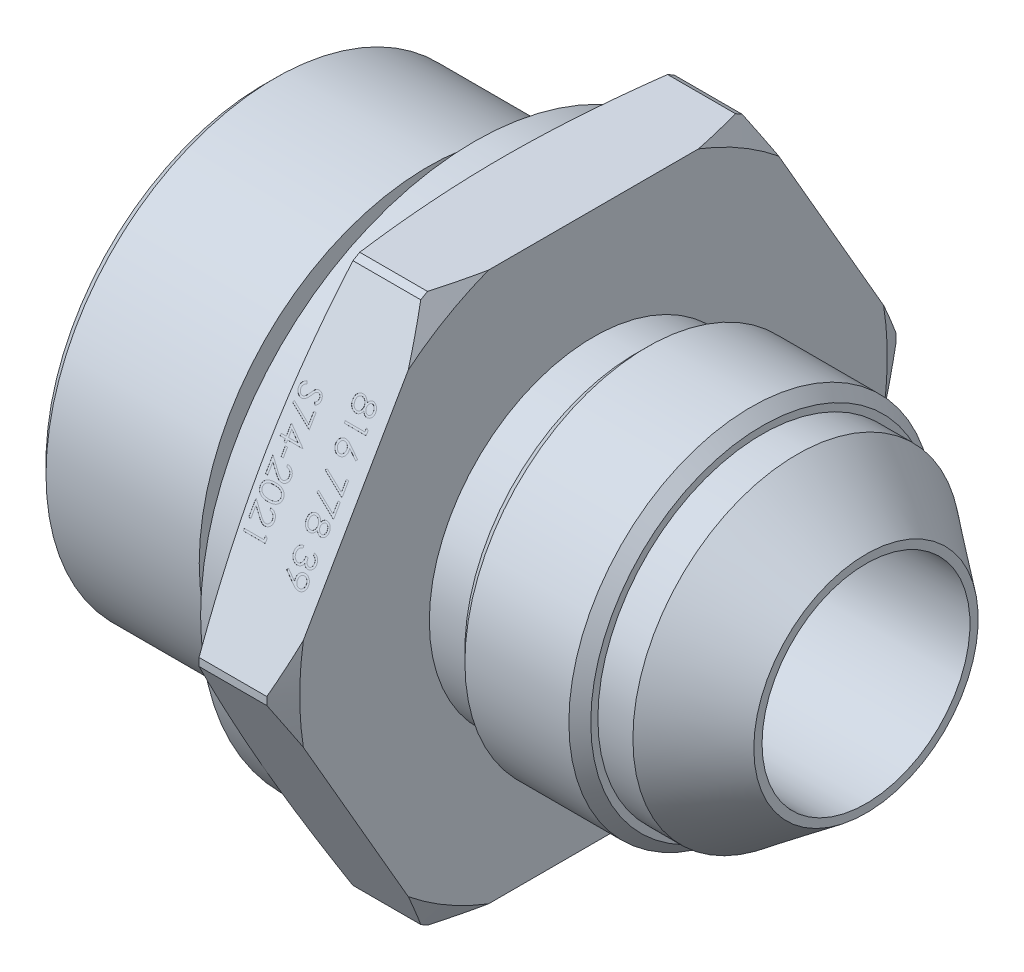
from build123d import *

# Parameters (mm, degrees)
SKETCH2_OUTSIDE_W  = 79.134
SKETCH2_OUTSIDE_H  = 79.134
EXTRUDE1_DEPTH     = 10.9
CHAMFER1_SIZE      = 1
CHAMFER2_SIZE      = 1
SKETCH3_W          = 0.205128205
SKETCH3_H          = 0.769230769
CUT_EXTRUDE1_DEPTH = 0.01


with BuildPart() as part:
    # Sketch1 → Revolve1 (revolve)
    with BuildSketch(Plane.XY, mode=Mode.PRIVATE) as revolve1_sk:
        Polygon((0, 18.4), (0, 20.925), (15, 20.925), (15, 19.03358675), (19.2, 19.03358675), (19.2, 25), (21.8, 25), (22.804809472, 28.75), (29, 28.75), (30.1, 26.844744112), (30.1, 15), (34, 15), (34, 16.65), (45.5, 16.65), (45.5, 15), (48.7, 15), (55, 10.252609484), (55, 9.5), (12.804733405, 9.5), (9.5, 15), (4.511952394, 15), align=None)
    revolve(revolve1_sk.sketch.rotate(Axis((0, 0, 0), (1, 0, 0)), 90), axis=Axis((0, 0, 0), (1, 0, 0)))

    # Sketch2 outside → Extrude1 (cut)
    with BuildSketch(Plane(origin=(30.1, 0, 0), x_dir=(0, 0, -1), z_dir=(1, 0, 0))):
        Rectangle(SKETCH2_OUTSIDE_W, SKETCH2_OUTSIDE_H)
        Polygon((14.477058, 25.075), (-14.477058, 25.075), (-28.954116, 0), (-14.477058, -25.075), (14.477058, -25.075), (28.954116, 0), align=None, mode=Mode.SUBTRACT)
    extrude(amount=-EXTRUDE1_DEPTH, mode=Mode.SUBTRACT)

    # Chamfer1
    chamfer1_edges = [part.edges().sort_by_distance(p)[0] for p in [
        (0, 0, -20.925),
    ]]
    chamfer(chamfer1_edges, length=CHAMFER1_SIZE)

    # Chamfer2
    chamfer2_edges = [part.edges().sort_by_distance(p)[0] for p in [
        (45.5, 0, -16.65),
        (34, 0, -16.65),
    ]]
    chamfer(chamfer2_edges, length=CHAMFER2_SIZE)

    # Sketch3 → Cut-Extrude1 (cut)
    # profile 1 of 16: a face of its own
    with BuildSketch(Plane(origin=(0, 12.5375, 21.715587), x_dir=(1, 0, 0), z_dir=(0, 0.5, 0.8660254037844386))):
        with BuildLine():
            add(Edge.make_bspline(
                [(27.972174043, 5.721850158), (27.963627633, 5.70561796), (27.94690714, 5.673860725), (27.920070835, 5.628422144), (27.892036796, 5.586587603), (27.863685035, 5.547760903), (27.833894893, 5.512733978), (27.803006402, 5.481275054), (27.771846969, 5.452397184), (27.739197376, 5.427618582), (27.705731028, 5.405768416), (27.67116025, 5.38691048), (27.635594084, 5.370784735), (27.598635509, 5.358006346), (27.56082975, 5.34747949), (27.521688018, 5.340236319), (27.481468402, 5.336340929), (27.454286514, 5.335604465), (27.440523402, 5.335231568)],
                knots=[0, 0, 0, 0, 1.264385854, 2.473688339, 3.635349404, 4.734491366, 5.785876313, 6.801388178, 7.772322209, 8.711311751, 9.622826105, 10.524996139, 11.423212571, 12.31118177, 13.217849097, 14.126010572, 15.051135535, 16, 16, 16, 16], degree=3))
            add(Edge.make_bspline(
                [(27.440523402, 5.335231568), (27.421266232, 5.335668459), (27.383149069, 5.33653323), (27.326913372, 5.344190229), (27.272167109, 5.35536546), (27.219439556, 5.372767712), (27.168069971, 5.393553617), (27.118997609, 5.420293468), (27.070850281, 5.450301407), (27.041242204, 5.474453148), (27.026260581, 5.486673876)],
                knots=[0, 0, 0, 0, 1.02534174, 2.029536028, 3.018826961, 3.997522084, 4.983122576, 5.966563916, 6.971085759, 8, 8, 8, 8], degree=3))
            add(Edge.make_bspline(
                [(27.026260581, 5.486673876), (27.008778425, 5.502580433), (26.974030143, 5.534196985), (26.928915395, 5.588358658), (26.891001455, 5.647799734), (26.86010323, 5.71229021), (26.836054168, 5.781657696), (26.818772729, 5.855887413), (26.808874198, 5.935124072), (26.807443346, 5.989584341), (26.806709299, 6.017523235)],
                knots=[0, 0, 0, 0, 0.954267603, 1.896743057, 2.838368354, 3.796610408, 4.779680527, 5.799409237, 6.871065594, 8, 8, 8, 8], degree=3))
            add(Edge.make_bspline(
                [(26.806709299, 6.017523235), (26.807369625, 6.04438741), (26.808654553, 6.096662366), (26.817312755, 6.172761098), (26.832641079, 6.243783194), (26.853187204, 6.310065366), (26.880585928, 6.370966748), (26.914168845, 6.426597851), (26.953177408, 6.477774854), (26.998551733, 6.522889306), (27.047157587, 6.562939271), (27.097301018, 6.598121162), (27.148988739, 6.627363455), (27.201449497, 6.652121805), (27.255418734, 6.671074959), (27.31061874, 6.684201937), (27.366953108, 6.692538687), (27.404971196, 6.693647907), (27.42409712, 6.694205927)],
                knots=[0, 0, 0, 0, 1.256882982, 2.445766618, 3.576898315, 4.651879663, 5.686612882, 6.692806257, 7.686348993, 8.689277895, 9.678883454, 10.630458183, 11.551151498, 12.454054546, 13.341321255, 14.221808008, 15.105437234, 16, 16, 16, 16], degree=3))
            add(Edge.make_bspline(
                [(27.42409712, 6.694205927), (27.438130955, 6.693875726), (27.465866765, 6.69322313), (27.506843371, 6.688705844), (27.546727445, 6.681444719), (27.585662907, 6.671579016), (27.62337887, 6.658224417), (27.660007121, 6.642042344), (27.695829084, 6.623356516), (27.73022894, 6.600959505), (27.764353121, 6.576301487), (27.796534863, 6.547051472), (27.828566947, 6.514971063), (27.859063347, 6.478750455), (27.88948984, 6.43949827), (27.917910133, 6.396024808), (27.946403654, 6.349551471), (27.963436525, 6.316519334), (27.972174043, 6.299574517)],
                knots=[0, 0, 0, 0, 0.941717298, 1.86116577, 2.762973304, 3.660719123, 4.553575492, 5.444450535, 6.34648071, 7.261375261, 8.197060099, 9.168336537, 10.175980388, 11.237504102, 12.343496232, 13.506792996, 14.721035322, 16, 16, 16, 16], degree=3))
            add(Edge.make_bspline(
                [(27.972174043, 6.299574517), (27.984820512, 6.322771991), (28.009307615, 6.367688794), (28.054332481, 6.427124501), (28.102918816, 6.478259266), (28.156672413, 6.519111399), (28.213225765, 6.551527902), (28.272397642, 6.574419318), (28.333479521, 6.589367695), (28.375132957, 6.590881539), (28.396052248, 6.591641825)],
                knots=[0, 0, 0, 0, 1.16709546, 2.25982348, 3.287408737, 4.277418348, 5.234967981, 6.16072867, 7.076276605, 8, 8, 8, 8], degree=3))
            add(Edge.make_bspline(
                [(28.396052248, 6.591641825), (28.417365116, 6.590707279), (28.460207697, 6.588828678), (28.523982973, 6.573638488), (28.586619614, 6.548883046), (28.64782269, 6.51521833), (28.705487209, 6.473265705), (28.757380313, 6.422943954), (28.802444188, 6.365114109), (28.840515627, 6.300802942), (28.871655711, 6.231729541), (28.892913139, 6.158725139), (28.906894543, 6.08309435), (28.908473045, 6.031608956), (28.909273402, 6.005504004)],
                knots=[0, 0, 0, 0, 0.888753872, 1.786550278, 2.720173491, 3.693036334, 4.694165094, 5.687489879, 6.699912706, 7.744713188, 8.800178723, 9.852977058, 10.911381959, 12, 12, 12, 12], degree=3))
            add(Edge.make_bspline(
                [(28.909273402, 6.005504004), (28.90845046, 5.980072336), (28.906827713, 5.929923983), (28.893160846, 5.856100415), (28.870588428, 5.78540684), (28.839853281, 5.718229016), (28.801525629, 5.656034756), (28.75600714, 5.60050491), (28.704296374, 5.551794882), (28.646788027, 5.511324202), (28.585586435, 5.478664009), (28.521935656, 5.455404961), (28.456688627, 5.440610311), (28.412555147, 5.438735163), (28.390443274, 5.437795671)],
                knots=[0, 0, 0, 0, 1.072712831, 2.115267497, 3.156282165, 4.197922255, 5.225560591, 6.230883479, 7.219814004, 8.214446311, 9.19021444, 10.138875805, 11.067534608, 12, 12, 12, 12], degree=3))
            add(Edge.make_bspline(
                [(28.390443274, 5.437795671), (28.368742194, 5.438615302), (28.326122508, 5.440225011), (28.263994903, 5.453769514), (28.205804031, 5.476570853), (28.150931182, 5.507734154), (28.100135549, 5.548287473), (28.053586018, 5.598161341), (28.009432133, 5.655807963), (27.984871018, 5.69934401), (27.972174043, 5.721850158)],
                knots=[0, 0, 0, 0, 0.975287281, 1.915408787, 2.843441052, 3.776938647, 4.743139116, 5.754296123, 6.83907365, 8, 8, 8, 8], degree=3))
        make_face()
        with BuildLine():
            add(Edge.make_bspline(
                [(28.704145197, 6.01552003), (28.703772945, 6.029549062), (28.703044658, 6.056995983), (28.699239722, 6.097240938), (28.691837884, 6.135510862), (28.681987192, 6.172205605), (28.66867977, 6.206822069), (28.653025479, 6.239830386), (28.633993442, 6.27066878), (28.612644186, 6.299709525), (28.589162525, 6.325852824), (28.564697543, 6.349055425), (28.538768748, 6.368328633), (28.512021113, 6.384694982), (28.483660784, 6.396570135), (28.454557255, 6.405464023), (28.42434275, 6.411476246), (28.403693315, 6.411926755), (28.393247761, 6.412154645)],
                knots=[0, 0, 0, 0, 1.203892937, 2.355340988, 3.463153438, 4.544400666, 5.610487187, 6.640501085, 7.674077295, 8.714426146, 9.728707835, 10.68524104, 11.601827946, 12.495867327, 13.368432065, 14.231010473, 15.105153427, 16, 16, 16, 16], degree=3))
            add(Edge.make_bspline(
                [(28.393247761, 6.412154645), (28.382806462, 6.4117483), (28.362172955, 6.410945303), (28.331580902, 6.405133185), (28.301909557, 6.395415274), (28.272881931, 6.382089928), (28.244572534, 6.364989341), (28.216872884, 6.344234336), (28.190515476, 6.318924357), (28.164752501, 6.290974503), (28.141016691, 6.260444233), (28.119814567, 6.228362474), (28.10291242, 6.194495089), (28.088092691, 6.159856329), (28.076976176, 6.123713666), (28.068967382, 6.086316306), (28.064013443, 6.047704197), (28.063419876, 6.021544309), (28.063119556, 6.008308492)],
                knots=[0, 0, 0, 0, 0.873213166, 1.72559466, 2.594724523, 3.479581045, 4.391597569, 5.35687048, 6.368548091, 7.443976143, 8.534559525, 9.600545123, 10.654815915, 11.696401765, 12.749428718, 13.812189468, 14.893058657, 16, 16, 16, 16], degree=3))
            add(Edge.make_bspline(
                [(28.063119556, 6.008308492), (28.063618337, 5.991308432), (28.064610973, 5.957476222), (28.073840215, 5.907602318), (28.088357882, 5.859109379), (28.10822072, 5.812515719), (28.133150926, 5.769027385), (28.162998365, 5.730261631), (28.197073849, 5.696549121), (28.234846898, 5.668240201), (28.275047806, 5.646291717), (28.31539083, 5.62920497), (28.356306391, 5.619227133), (28.383716084, 5.617925666), (28.397254171, 5.617282851)],
                knots=[0, 0, 0, 0, 1.076279235, 2.141928126, 3.20205304, 4.278698113, 5.344010996, 6.36967002, 7.368914609, 8.37248503, 9.349703398, 10.264243087, 11.142681841, 12, 12, 12, 12], degree=3))
            add(Edge.make_bspline(
                [(28.397254171, 5.617282851), (28.406756364, 5.617586006), (28.425616856, 5.618187727), (28.453460611, 5.623170743), (28.48070333, 5.63134124), (28.507351613, 5.642610943), (28.533780188, 5.656572101), (28.558873329, 5.674607349), (28.584027532, 5.695080399), (28.608128043, 5.718863331), (28.630821606, 5.745674665), (28.650343906, 5.775937674), (28.667298708, 5.808882561), (28.680922125, 5.844778101), (28.691182686, 5.883484228), (28.698858353, 5.924853101), (28.703186487, 5.969220923), (28.703818696, 5.999752271), (28.704145197, 6.01552003)],
                knots=[0, 0, 0, 0, 0.814272661, 1.61621452, 2.416847352, 3.248328223, 4.093649164, 4.973549185, 5.892801723, 6.872536627, 7.872406081, 8.898230315, 9.953166191, 11.044090313, 12.18293744, 13.382234284, 14.648068262, 16, 16, 16, 16], degree=3))
        make_face(mode=Mode.SUBTRACT)
        with BuildLine():
            add(Edge.make_bspline(
                [(27.857991351, 6.00390144), (27.857675103, 6.021687667), (27.857054703, 6.056579904), (27.850144731, 6.107697248), (27.840534073, 6.156759479), (27.825922811, 6.203581861), (27.807081089, 6.248106989), (27.784028726, 6.290435164), (27.757186497, 6.330626281), (27.726407749, 6.368021804), (27.693073585, 6.402093023), (27.658235771, 6.432510066), (27.62164408, 6.457828833), (27.583624921, 6.478517562), (27.544225657, 6.494543692), (27.503454202, 6.506377208), (27.461188692, 6.51324639), (27.432534672, 6.514225226), (27.418087505, 6.514718748)],
                knots=[0, 0, 0, 0, 1.140506561, 2.237395584, 3.304560074, 4.345354409, 5.3782877, 6.402081073, 7.433555996, 8.474808822, 9.504965884, 10.489266388, 11.437701257, 12.354123303, 13.261162422, 14.161620169, 15.073101032, 16, 16, 16, 16], degree=3))
            add(Edge.make_bspline(
                [(27.418087505, 6.514718748), (27.400125837, 6.513941892), (27.364490309, 6.512400628), (27.311842758, 6.500107796), (27.260730994, 6.480532231), (27.21205434, 6.45255581), (27.166419168, 6.418638662), (27.126183791, 6.377204436), (27.091204799, 6.329872735), (27.062523846, 6.276171413), (27.039517276, 6.217592396), (27.023863139, 6.153983863), (27.013421861, 6.086243855), (27.012373946, 6.039466149), (27.011837505, 6.01552003)],
                knots=[0, 0, 0, 0, 0.898956152, 1.783507998, 2.694187257, 3.631865312, 4.587204618, 5.533364321, 6.51415483, 7.525942309, 8.574485006, 9.65837228, 10.801290154, 12, 12, 12, 12], degree=3))
            add(Edge.make_bspline(
                [(27.011837505, 6.01552003), (27.012196417, 5.996805373), (27.012895692, 5.960343219), (27.019080925, 5.907153481), (27.028860642, 5.856948647), (27.043220907, 5.809753351), (27.060425373, 5.765002022), (27.082925174, 5.723695382), (27.108370589, 5.684733223), (27.138572092, 5.649944553), (27.170870911, 5.61830689), (27.204887422, 5.590596357), (27.24027519, 5.567144335), (27.277014973, 5.548239849), (27.314971379, 5.533227856), (27.354300316, 5.522405924), (27.39515624, 5.515736061), (27.422869789, 5.515060955), (27.436917633, 5.514718748)],
                knots=[0, 0, 0, 0, 1.22469164, 2.386092043, 3.500511288, 4.568136916, 5.611981868, 6.63276519, 7.641422348, 8.65223666, 9.641383647, 10.598487484, 11.519869765, 12.415254456, 13.298392158, 14.187051141, 15.081026348, 16, 16, 16, 16], degree=3))
            add(Edge.make_bspline(
                [(27.436917633, 5.514718748), (27.450563357, 5.515232984), (27.477470342, 5.516246967), (27.517314742, 5.522774272), (27.55596553, 5.533981724), (27.593256388, 5.550315983), (27.629590353, 5.570404982), (27.664698972, 5.59504682), (27.698303821, 5.624530165), (27.730439949, 5.657924838), (27.760165566, 5.694296969), (27.786458916, 5.732965071), (27.808603145, 5.773624457), (27.826612527, 5.816190945), (27.840776807, 5.860569527), (27.850671659, 5.906727692), (27.856900004, 5.954719447), (27.857623459, 5.987322231), (27.857991351, 6.00390144)],
                knots=[0, 0, 0, 0, 0.917481483, 1.809113215, 2.707052678, 3.61610275, 4.54058801, 5.494688304, 6.493986409, 7.541809048, 8.607637092, 9.648666143, 10.681335566, 11.715370464, 12.751897579, 13.808646822, 14.885650252, 16, 16, 16, 16], degree=3))
        make_face(mode=Mode.SUBTRACT)
    # profile 2 of 16: a face of its own
    with BuildSketch(Plane(origin=(0, 12.5375, 21.715587), x_dir=(1, 0, 0), z_dir=(0, 0.5, 0.8660254037844386))):
        Polygon((28.857991351, 4.730664261), (28.857991351, 4.360872594), (26.857991351, 4.360872594), (26.857991351, 4.540359774), (28.652863146, 4.540359774), (28.652863146, 4.848052081), align=None)
    # profile 3 of 16: a face of its own
    with BuildSketch(Plane(origin=(0, 12.5375, 21.715587), x_dir=(1, 0, 0), z_dir=(0, 0.5, 0.8660254037844386))):
        with BuildLine():
            Line((28.909273402, 2.694205927), (28.800699684, 2.555584133))
            Line((28.800699684, 2.555584133), (27.992606735, 3.084029645))
            add(Edge.make_bspline(
                [(27.992606735, 3.084029645), (27.998214656, 3.04884663), (28.009153538, 2.98021818), (28.010958079, 2.910751953), (28.011837505, 2.876898235)],
                knots=[0, 0, 0, 0, 1.025318673, 2, 2, 2, 2], degree=3))
            add(Edge.make_bspline(
                [(28.011837505, 2.876898235), (28.011299068, 2.856570071), (28.010242677, 2.816687038), (28.001894346, 2.758084504), (27.988900214, 2.70176028), (27.969882513, 2.647840015), (27.94559678, 2.596255279), (27.916488495, 2.546711101), (27.881056776, 2.50013851), (27.841476774, 2.45593784), (27.797638504, 2.415808069), (27.751123453, 2.380278895), (27.701980093, 2.350435014), (27.650233312, 2.326221344), (27.595962878, 2.307418557), (27.539238227, 2.293711331), (27.480020243, 2.285608706), (27.439747, 2.284508426), (27.419289428, 2.283949517)],
                knots=[0, 0, 0, 0, 1.044136307, 2.048553127, 3.035567123, 4.010001674, 4.980053131, 5.96154148, 6.956538004, 7.981742224, 9.006487041, 10.005615874, 10.984750588, 11.954802044, 12.935714515, 13.930994945, 14.949008866, 16, 16, 16, 16], degree=3))
            add(Edge.make_bspline(
                [(27.419289428, 2.283949517), (27.391317663, 2.284993248), (27.336308305, 2.287045852), (27.255852639, 2.301987937), (27.179819446, 2.327774637), (27.107909926, 2.36227415), (27.042216292, 2.407034556), (26.982846863, 2.460078097), (26.931097683, 2.521906183), (26.886704218, 2.591054713), (26.851433666, 2.665894897), (26.825357427, 2.744367277), (26.809776211, 2.825801116), (26.807736306, 2.881105896), (26.806709299, 2.908949517)],
                knots=[0, 0, 0, 0, 1.031881447, 2.029301251, 3.006342947, 3.987068354, 4.962916383, 5.929513747, 6.915671209, 7.928552063, 8.953527267, 9.960179832, 10.973036711, 12, 12, 12, 12], degree=3))
            add(Edge.make_bspline(
                [(26.806709299, 2.908949517), (26.807582558, 2.935861923), (26.809312329, 2.989170686), (26.824721469, 3.06758935), (26.849696834, 3.142939933), (26.884105453, 3.214692783), (26.927565391, 3.281165728), (26.979892995, 3.340616973), (27.039931766, 3.392839673), (27.107865881, 3.43607083), (27.180395402, 3.47130434), (27.256712214, 3.496155044), (27.33528041, 3.512226059), (27.388762702, 3.513884135), (27.415683658, 3.514718748)],
                knots=[0, 0, 0, 0, 1.011913813, 2.004424092, 2.994488568, 3.992479987, 4.990471406, 5.973328987, 6.963763268, 7.974390938, 8.994854117, 9.989689954, 10.988086187, 12, 12, 12, 12], degree=3))
            add(Edge.make_bspline(
                [(27.415683658, 3.514718748), (27.436273064, 3.51399392), (27.478293988, 3.512514619), (27.542119953, 3.503686322), (27.607171704, 3.487494146), (27.662317792, 3.469970673), (27.707988743, 3.452582098), (27.744053888, 3.436459011), (27.782139838, 3.418431435), (27.82152597, 3.397300605), (27.863337633, 3.374900221), (27.906026411, 3.34873403), (27.951151431, 3.321429207), (27.981194969, 3.30142639), (27.996613146, 3.291161056)],
                knots=[0, 0, 0, 0, 1.17367173, 2.395347028, 3.66355231, 4.98980831, 5.690886799, 6.447442954, 7.240630024, 8.091733897, 8.994365608, 9.943299771, 10.944512865, 12, 12, 12, 12], degree=3))
            Line((27.996613146, 3.291161056), (28.909273402, 2.694205927))
        make_face()
        with BuildLine():
            add(Edge.make_bspline(
                [(27.806709299, 2.914558492), (27.806258813, 2.929793581), (27.805374962, 2.959684701), (27.800382982, 3.00348399), (27.790924494, 3.044825185), (27.778689902, 3.084180761), (27.762030982, 3.121139483), (27.742037942, 3.156126806), (27.718258639, 3.188781212), (27.690998757, 3.218582941), (27.661409085, 3.245847958), (27.629958542, 3.269850161), (27.596774598, 3.290084136), (27.562142765, 3.306616094), (27.525882061, 3.319460029), (27.488192573, 3.328758221), (27.448812562, 3.333931241), (27.422108331, 3.334792021), (27.40847212, 3.335231568)],
                knots=[0, 0, 0, 0, 1.129054775, 2.21519617, 3.259426851, 4.267013074, 5.263608451, 6.256463875, 7.247987236, 8.249677815, 9.244060445, 10.225610515, 11.175892485, 12.118571871, 13.063688666, 14.021206195, 14.989551517, 16, 16, 16, 16], degree=3))
            add(Edge.make_bspline(
                [(27.40847212, 3.335231568), (27.39495836, 3.334872725), (27.368459889, 3.334169088), (27.329401588, 3.327809494), (27.291849175, 3.318025798), (27.255775182, 3.30370506), (27.221376388, 3.285742668), (27.188408447, 3.263637963), (27.156848606, 3.237765232), (27.127492691, 3.207688696), (27.100566732, 3.175254068), (27.076591807, 3.1409523), (27.056459282, 3.104892459), (27.040542933, 3.066868784), (27.027507065, 3.027413637), (27.018327266, 2.986226026), (27.013138884, 2.943269763), (27.012276991, 2.91417156), (27.011837505, 2.899334133)],
                knots=[0, 0, 0, 0, 0.989642335, 1.94054129, 2.892446913, 3.828371744, 4.778262963, 5.730973156, 6.732161388, 7.763274768, 8.805796303, 9.818398792, 10.825975928, 11.825728216, 12.834635236, 13.867465554, 14.912602056, 16, 16, 16, 16], degree=3))
            add(Edge.make_bspline(
                [(27.011837505, 2.899334133), (27.012276957, 2.884496681), (27.013138781, 2.85539843), (27.018327653, 2.812442513), (27.027505642, 2.771253625), (27.040548091, 2.73180312), (27.056440147, 2.693762307), (27.07671796, 2.657670901), (27.100420962, 2.623041643), (27.127539033, 2.590628293), (27.156682731, 2.560426045), (27.1886942, 2.53515931), (27.221114363, 2.512356268), (27.255912259, 2.49508376), (27.291827458, 2.480603534), (27.329407406, 2.470869201), (27.368458366, 2.464496447), (27.394957846, 2.463794618), (27.40847212, 2.463436697)],
                knots=[0, 0, 0, 0, 1.087205562, 2.132157158, 3.164804748, 4.173533273, 5.173108684, 6.180507559, 7.20098426, 8.243321352, 9.274252308, 10.269075238, 11.227079059, 12.172305571, 13.108064818, 14.05980203, 15.010532752, 16, 16, 16, 16], degree=3))
            add(Edge.make_bspline(
                [(27.40847212, 2.463436697), (27.422127734, 2.463747485), (27.448929263, 2.464357461), (27.488156748, 2.471390227), (27.526189826, 2.480889149), (27.562171741, 2.496240278), (27.597097539, 2.514524725), (27.629969012, 2.537817909), (27.661717417, 2.564524115), (27.691173968, 2.595452493), (27.718117327, 2.6290998), (27.74189936, 2.664881258), (27.761970917, 2.70231409), (27.778717827, 2.741362135), (27.790803119, 2.782472337), (27.800319764, 2.824981092), (27.805366677, 2.869299323), (27.806257344, 2.899323275), (27.806709299, 2.914558492)],
                knots=[0, 0, 0, 0, 0.978850575, 1.921165339, 2.853482305, 3.786193361, 4.721019802, 5.678231452, 6.671107257, 7.694736563, 8.738100728, 9.761595396, 10.773671158, 11.783065439, 12.804898115, 13.84455739, 14.906252091, 16, 16, 16, 16], degree=3))
        make_face(mode=Mode.SUBTRACT)
    # profile 4 of 16: a face of its own
    with BuildSketch(Plane(origin=(0, 12.5375, 21.715587), x_dir=(1, 0, 0), z_dir=(0, 0.5, 0.8660254037844386))):
        Polygon((28.857991351, 1.181385415), (28.857991351, -0.049383816), (26.806709299, 1.001898235), (26.892045838, 1.156946312), (28.652863146, 0.254702722), (28.652863146, 1.181385415), align=None)
    # profile 5 of 16: a face of its own
    with BuildSketch(Plane(origin=(0, 12.5375, 21.715587), x_dir=(1, 0, 0), z_dir=(0, 0.5, 0.8660254037844386))):
        Polygon((28.857991351, -0.357076124), (28.857991351, -1.587845355), (26.806709299, -0.536563303), (26.892045838, -0.381515226), (28.652863146, -1.283758816), (28.652863146, -0.357076124), align=None)
    # profile 6 of 16: a face of its own
    with BuildSketch(Plane(origin=(0, 12.5375, 21.715587), x_dir=(1, 0, 0), z_dir=(0, 0.5, 0.8660254037844386))):
        with BuildLine():
            add(Edge.make_bspline(
                [(27.972174043, -2.739688303), (27.963627633, -2.755920501), (27.94690714, -2.787677737), (27.920070835, -2.833116317), (27.892036796, -2.874950859), (27.863685035, -2.913777559), (27.833894893, -2.948804484), (27.803006402, -2.980263407), (27.771846969, -3.009141278), (27.739197376, -3.03391988), (27.705731028, -3.055770046), (27.67116025, -3.074627982), (27.635594084, -3.090753726), (27.598635509, -3.103532116), (27.56082975, -3.114058972), (27.521688018, -3.121302143), (27.481468402, -3.125197533), (27.454286514, -3.125933997), (27.440523402, -3.126306893)],
                knots=[0, 0, 0, 0, 1.264385854, 2.473688339, 3.635349404, 4.734491366, 5.785876313, 6.801388178, 7.772322209, 8.711311751, 9.622826105, 10.524996139, 11.423212571, 12.31118177, 13.217849097, 14.126010572, 15.051135535, 16, 16, 16, 16], degree=3))
            add(Edge.make_bspline(
                [(27.440523402, -3.126306893), (27.421266232, -3.125870002), (27.383149069, -3.125005232), (27.326913372, -3.117348232), (27.272167109, -3.106173001), (27.219439556, -3.08877075), (27.168069971, -3.067984844), (27.118997609, -3.041244993), (27.070850281, -3.011237055), (27.041242204, -2.987085314), (27.026260581, -2.974864585)],
                knots=[0, 0, 0, 0, 1.02534174, 2.029536028, 3.018826961, 3.997522084, 4.983122576, 5.966563916, 6.971085759, 8, 8, 8, 8], degree=3))
            add(Edge.make_bspline(
                [(27.026260581, -2.974864585), (27.008778425, -2.958958029), (26.974030143, -2.927341477), (26.928915395, -2.873179804), (26.891001455, -2.813738727), (26.86010323, -2.749248252), (26.836054168, -2.679880765), (26.818772729, -2.605651048), (26.808874198, -2.526414389), (26.807443346, -2.47195412), (26.806709299, -2.444015226)],
                knots=[0, 0, 0, 0, 0.954267603, 1.896743057, 2.838368354, 3.796610408, 4.779680527, 5.799409237, 6.871065594, 8, 8, 8, 8], degree=3))
            add(Edge.make_bspline(
                [(26.806709299, -2.444015226), (26.807369625, -2.417151052), (26.808654553, -2.364876096), (26.817312755, -2.288777363), (26.832641079, -2.217755268), (26.853187204, -2.151473096), (26.880585928, -2.090571714), (26.914168845, -2.034940611), (26.953177408, -1.983763608), (26.998551733, -1.938649155), (27.047157587, -1.89859919), (27.097301018, -1.863417299), (27.148988739, -1.834175006), (27.201449497, -1.809416656), (27.255418734, -1.790463503), (27.31061874, -1.777336525), (27.366953108, -1.768999774), (27.404971196, -1.767890554), (27.42409712, -1.767332534)],
                knots=[0, 0, 0, 0, 1.256882982, 2.445766618, 3.576898315, 4.651879663, 5.686612882, 6.692806257, 7.686348993, 8.689277895, 9.678883454, 10.630458183, 11.551151498, 12.454054546, 13.341321255, 14.221808008, 15.105437234, 16, 16, 16, 16], degree=3))
            add(Edge.make_bspline(
                [(27.42409712, -1.767332534), (27.438130955, -1.767662736), (27.465866765, -1.768315331), (27.506843371, -1.772832618), (27.546727445, -1.780093742), (27.585662907, -1.789959445), (27.62337887, -1.803314045), (27.660007121, -1.819496117), (27.695829084, -1.838181946), (27.73022894, -1.860578956), (27.764353121, -1.885236975), (27.796534863, -1.91448699), (27.828566947, -1.946567399), (27.859063347, -1.982788007), (27.88948984, -2.022040191), (27.917910133, -2.065513653), (27.946403654, -2.111986991), (27.963436525, -2.145019127), (27.972174043, -2.161963944)],
                knots=[0, 0, 0, 0, 0.941717298, 1.86116577, 2.762973304, 3.660719123, 4.553575492, 5.444450535, 6.34648071, 7.261375261, 8.197060099, 9.168336537, 10.175980388, 11.237504102, 12.343496232, 13.506792996, 14.721035322, 16, 16, 16, 16], degree=3))
            add(Edge.make_bspline(
                [(27.972174043, -2.161963944), (27.984820512, -2.13876647), (28.009307615, -2.093849668), (28.054332481, -2.034413961), (28.102918816, -1.983279196), (28.156672413, -1.942427062), (28.213225765, -1.910010559), (28.272397642, -1.887119143), (28.333479521, -1.872170766), (28.375132957, -1.870656923), (28.396052248, -1.869896637)],
                knots=[0, 0, 0, 0, 1.16709546, 2.25982348, 3.287408737, 4.277418348, 5.234967981, 6.16072867, 7.076276605, 8, 8, 8, 8], degree=3))
            add(Edge.make_bspline(
                [(28.396052248, -1.869896637), (28.417365116, -1.870831183), (28.460207697, -1.872709784), (28.523982973, -1.887899974), (28.586619614, -1.912655415), (28.64782269, -1.946320132), (28.705487209, -1.988272756), (28.757380313, -2.038594507), (28.802444188, -2.096424353), (28.840515627, -2.160735519), (28.871655711, -2.229808921), (28.892913139, -2.302813322), (28.906894543, -2.378444111), (28.908473045, -2.429929506), (28.909273402, -2.456034457)],
                knots=[0, 0, 0, 0, 0.888753872, 1.786550278, 2.720173491, 3.693036334, 4.694165094, 5.687489879, 6.699912706, 7.744713188, 8.800178723, 9.852977058, 10.911381959, 12, 12, 12, 12], degree=3))
            add(Edge.make_bspline(
                [(28.909273402, -2.456034457), (28.90845046, -2.481466126), (28.906827713, -2.531614479), (28.893160846, -2.605438047), (28.870588428, -2.676131621), (28.839853281, -2.743309446), (28.801525629, -2.805503705), (28.75600714, -2.861033552), (28.704296374, -2.90974358), (28.646788027, -2.95021426), (28.585586435, -2.982874453), (28.521935656, -3.0061335), (28.456688627, -3.02092815), (28.412555147, -3.022803299), (28.390443274, -3.023742791)],
                knots=[0, 0, 0, 0, 1.072712831, 2.115267497, 3.156282165, 4.197922255, 5.225560591, 6.230883479, 7.219814004, 8.214446311, 9.19021444, 10.138875805, 11.067534608, 12, 12, 12, 12], degree=3))
            add(Edge.make_bspline(
                [(28.390443274, -3.023742791), (28.368742194, -3.022923159), (28.326122508, -3.02131345), (28.263994903, -3.007768948), (28.205804031, -2.984967609), (28.150931182, -2.953804308), (28.100135549, -2.913250988), (28.053586018, -2.863377121), (28.009432133, -2.805730499), (27.984871018, -2.762194452), (27.972174043, -2.739688303)],
                knots=[0, 0, 0, 0, 0.975287281, 1.915408787, 2.843441052, 3.776938647, 4.743139116, 5.754296123, 6.83907365, 8, 8, 8, 8], degree=3))
        make_face()
        with BuildLine():
            add(Edge.make_bspline(
                [(28.704145197, -2.446018432), (28.703772945, -2.4319894), (28.703044658, -2.404542479), (28.699239722, -2.364297524), (28.691837884, -2.3260276), (28.681987192, -2.289332857), (28.66867977, -2.254716392), (28.653025479, -2.221708076), (28.633993442, -2.190869681), (28.612644186, -2.161828937), (28.589162525, -2.135685637), (28.564697543, -2.112483036), (28.538768748, -2.093209828), (28.512021113, -2.07684348), (28.483660784, -2.064968327), (28.454557255, -2.056074439), (28.42434275, -2.050062215), (28.403693315, -2.049611707), (28.393247761, -2.049383816)],
                knots=[0, 0, 0, 0, 1.203892937, 2.355340988, 3.463153438, 4.544400666, 5.610487187, 6.640501085, 7.674077295, 8.714426146, 9.728707835, 10.68524104, 11.601827946, 12.495867327, 13.368432065, 14.231010473, 15.105153427, 16, 16, 16, 16], degree=3))
            add(Edge.make_bspline(
                [(28.393247761, -2.049383816), (28.382806462, -2.049790162), (28.362172955, -2.050593158), (28.331580902, -2.056405277), (28.301909557, -2.066123188), (28.272881931, -2.079448534), (28.244572534, -2.09654912), (28.216872884, -2.117304126), (28.190515476, -2.142614104), (28.164752501, -2.170563958), (28.141016691, -2.201094228), (28.119814567, -2.233175988), (28.10291242, -2.267043372), (28.088092691, -2.301682132), (28.076976176, -2.337824796), (28.068967382, -2.375222155), (28.064013443, -2.413834264), (28.063419876, -2.439994152), (28.063119556, -2.45322997)],
                knots=[0, 0, 0, 0, 0.873213166, 1.72559466, 2.594724523, 3.479581045, 4.391597569, 5.35687048, 6.368548091, 7.443976143, 8.534559525, 9.600545123, 10.654815915, 11.696401765, 12.749428718, 13.812189468, 14.893058657, 16, 16, 16, 16], degree=3))
            add(Edge.make_bspline(
                [(28.063119556, -2.45322997), (28.063618337, -2.470230029), (28.064610973, -2.504062239), (28.073840215, -2.553936143), (28.088357882, -2.602429083), (28.10822072, -2.649022742), (28.133150926, -2.692511077), (28.162998365, -2.73127683), (28.197073849, -2.76498934), (28.234846898, -2.793298261), (28.275047806, -2.815246744), (28.31539083, -2.832333491), (28.356306391, -2.842311329), (28.383716084, -2.843612796), (28.397254171, -2.844255611)],
                knots=[0, 0, 0, 0, 1.076279235, 2.141928126, 3.20205304, 4.278698113, 5.344010996, 6.36967002, 7.368914609, 8.37248503, 9.349703398, 10.264243087, 11.142681841, 12, 12, 12, 12], degree=3))
            add(Edge.make_bspline(
                [(28.397254171, -2.844255611), (28.406756364, -2.843952455), (28.425616856, -2.843350735), (28.453460611, -2.838367718), (28.48070333, -2.830197221), (28.507351613, -2.818927518), (28.533780188, -2.80496636), (28.558873329, -2.786931113), (28.584027532, -2.766458062), (28.608128043, -2.74267513), (28.630821606, -2.715863797), (28.650343906, -2.685600788), (28.667298708, -2.652655901), (28.680922125, -2.616760361), (28.691182686, -2.578054234), (28.698858353, -2.53668536), (28.703186487, -2.492317539), (28.703818696, -2.46178619), (28.704145197, -2.446018432)],
                knots=[0, 0, 0, 0, 0.814272661, 1.61621452, 2.416847352, 3.248328223, 4.093649164, 4.973549185, 5.892801723, 6.872536627, 7.872406081, 8.898230315, 9.953166191, 11.044090313, 12.18293744, 13.382234284, 14.648068262, 16, 16, 16, 16], degree=3))
        make_face(mode=Mode.SUBTRACT)
        with BuildLine():
            add(Edge.make_bspline(
                [(27.857991351, -2.457637021), (27.857675103, -2.439850794), (27.857054703, -2.404958557), (27.850144731, -2.353841214), (27.840534073, -2.304778982), (27.825922811, -2.257956601), (27.807081089, -2.213431473), (27.784028726, -2.171103298), (27.757186497, -2.130912181), (27.726407749, -2.093516657), (27.693073585, -2.059445439), (27.658235771, -2.029028396), (27.62164408, -2.003709628), (27.583624921, -1.9830209), (27.544225657, -1.96699477), (27.503454202, -1.955161254), (27.461188692, -1.948292071), (27.432534672, -1.947313236), (27.418087505, -1.946819714)],
                knots=[0, 0, 0, 0, 1.140506561, 2.237395584, 3.304560074, 4.345354409, 5.3782877, 6.402081073, 7.433555996, 8.474808822, 9.504965884, 10.489266388, 11.437701257, 12.354123303, 13.261162422, 14.161620169, 15.073101032, 16, 16, 16, 16], degree=3))
            add(Edge.make_bspline(
                [(27.418087505, -1.946819714), (27.400125837, -1.947596569), (27.364490309, -1.949137833), (27.311842758, -1.961430666), (27.260730994, -1.98100623), (27.21205434, -2.008982652), (27.166419168, -2.0428998), (27.126183791, -2.084334026), (27.091204799, -2.131665727), (27.062523846, -2.185367049), (27.039517276, -2.243946066), (27.023863139, -2.307554599), (27.013421861, -2.375294606), (27.012373946, -2.422072312), (27.011837505, -2.446018432)],
                knots=[0, 0, 0, 0, 0.898956152, 1.783507998, 2.694187257, 3.631865312, 4.587204618, 5.533364321, 6.51415483, 7.525942309, 8.574485006, 9.65837228, 10.801290154, 12, 12, 12, 12], degree=3))
            add(Edge.make_bspline(
                [(27.011837505, -2.446018432), (27.012196417, -2.464733089), (27.012895692, -2.501195242), (27.019080925, -2.55438498), (27.028860642, -2.604589815), (27.043220907, -2.651785111), (27.060425373, -2.69653644), (27.082925174, -2.73784308), (27.108370589, -2.776805238), (27.138572092, -2.811593909), (27.170870911, -2.843231572), (27.204887422, -2.870942104), (27.24027519, -2.894394126), (27.277014973, -2.913298613), (27.314971379, -2.928310606), (27.354300316, -2.939132537), (27.39515624, -2.9458024), (27.422869789, -2.946477506), (27.436917633, -2.946819714)],
                knots=[0, 0, 0, 0, 1.22469164, 2.386092043, 3.500511288, 4.568136916, 5.611981868, 6.63276519, 7.641422348, 8.65223666, 9.641383647, 10.598487484, 11.519869765, 12.415254456, 13.298392158, 14.187051141, 15.081026348, 16, 16, 16, 16], degree=3))
            add(Edge.make_bspline(
                [(27.436917633, -2.946819714), (27.450563357, -2.946305478), (27.477470342, -2.945291495), (27.517314742, -2.93876419), (27.55596553, -2.927556737), (27.593256388, -2.911222478), (27.629590353, -2.891133479), (27.664698972, -2.866491642), (27.698303821, -2.837008297), (27.730439949, -2.803613623), (27.760165566, -2.767241492), (27.786458916, -2.728573391), (27.808603145, -2.687914005), (27.826612527, -2.645347516), (27.840776807, -2.600968935), (27.850671659, -2.55481077), (27.856900004, -2.506819014), (27.857623459, -2.474216231), (27.857991351, -2.457637021)],
                knots=[0, 0, 0, 0, 0.917481483, 1.809113215, 2.707052678, 3.61610275, 4.54058801, 5.494688304, 6.493986409, 7.541809048, 8.607637092, 9.648666143, 10.681335566, 11.715370464, 12.751897579, 13.808646822, 14.885650252, 16, 16, 16, 16], degree=3))
        make_face(mode=Mode.SUBTRACT)
    # profile 7 of 16: a face of its own
    with BuildSketch(Plane(origin=(0, 12.5375, 21.715587), x_dir=(1, 0, 0), z_dir=(0, 0.5, 0.8660254037844386))):
        with BuildLine():
            Line((28.396452889, -4.331435098), (28.396452889, -4.151947919))
            add(Edge.make_bspline(
                [(28.396452889, -4.151947919), (28.416585737, -4.156810519), (28.455943808, -4.166316505), (28.512176529, -4.18614369), (28.565389969, -4.207743264), (28.614587726, -4.233679896), (28.660758527, -4.261970612), (28.70285517, -4.294383596), (28.741948293, -4.329423437), (28.776641572, -4.368180551), (28.808057417, -4.408825501), (28.834843164, -4.451930998), (28.857885537, -4.496629794), (28.876868527, -4.543231584), (28.891168826, -4.591875111), (28.901544143, -4.64212061), (28.908281923, -4.694099753), (28.908939502, -4.729384091), (28.909273402, -4.747300483)],
                knots=[0, 0, 0, 0, 1.162005537, 2.271625781, 3.343758855, 4.383309926, 5.390229558, 6.379919256, 7.361854164, 8.333198761, 9.295911338, 10.242430842, 11.177959212, 12.116337295, 13.062827104, 14.020064771, 14.994644689, 16, 16, 16, 16], degree=3))
            add(Edge.make_bspline(
                [(28.909273402, -4.747300483), (28.90848527, -4.773404907), (28.906926199, -4.825044342), (28.892689378, -4.90090894), (28.870160731, -4.974067122), (28.839032887, -5.043718121), (28.800640136, -5.108414368), (28.754946001, -5.165977904), (28.702832114, -5.215628481), (28.645270649, -5.257282411), (28.583753215, -5.289896696), (28.52043884, -5.313946053), (28.455477713, -5.328587013), (28.411616411, -5.330484474), (28.389641992, -5.331435098)],
                knots=[0, 0, 0, 0, 1.083050992, 2.142477498, 3.193116406, 4.255571735, 5.30263384, 6.308962982, 7.297363603, 8.282367274, 9.249857812, 10.179914175, 11.08814088, 12, 12, 12, 12], degree=3))
            add(Edge.make_bspline(
                [(28.389641992, -5.331435098), (28.368495252, -5.330770189), (28.327114364, -5.329469065), (28.26670208, -5.318421233), (28.209764022, -5.299829083), (28.156060501, -5.274074933), (28.105932021, -5.240736904), (28.059265798, -5.200352506), (28.01585485, -5.152636699), (27.99098658, -5.116477306), (27.978183658, -5.09786138)],
                knots=[0, 0, 0, 0, 1.024540389, 2.004866551, 2.965041327, 3.920577974, 4.882998113, 5.874504559, 6.905732034, 8, 8, 8, 8], degree=3))
            add(Edge.make_bspline(
                [(27.978183658, -5.09786138), (27.967910417, -5.119136669), (27.947556156, -5.161289168), (27.90763858, -5.218746614), (27.861549239, -5.2709054), (27.825582009, -5.299993239), (27.807510581, -5.314608175)],
                knots=[0, 0, 0, 0, 1.015518401, 2.012035669, 3.001164323, 4, 4, 4, 4], degree=3))
            add(Edge.make_bspline(
                [(27.807510581, -5.314608175), (27.794336128, -5.324235717), (27.768202961, -5.343333142), (27.726161632, -5.366839074), (27.683793499, -5.38840735), (27.639432703, -5.404280978), (27.59450419, -5.417979289), (27.548045862, -5.426992321), (27.500499111, -5.432778328), (27.468318137, -5.433590801), (27.452141992, -5.433999201)],
                knots=[0, 0, 0, 0, 1.02516404, 2.033540309, 3.025129118, 4.011046665, 4.991655828, 5.976607087, 6.982917762, 8, 8, 8, 8], degree=3))
            add(Edge.make_bspline(
                [(27.452141992, -5.433999201), (27.42413755, -5.432971506), (27.368260457, -5.430920954), (27.285686769, -5.412666781), (27.205109204, -5.384204642), (27.127721658, -5.344492717), (27.055466471, -5.295358634), (26.991111026, -5.236579773), (26.935420217, -5.16958504), (26.889039276, -5.094812901), (26.851936524, -5.013838795), (26.826191263, -4.927222236), (26.809421616, -4.836222733), (26.807623475, -4.77381849), (26.806709299, -4.742092149)],
                knots=[0, 0, 0, 0, 0.95570045, 1.906903359, 2.87519758, 3.868912786, 4.869932978, 5.851730567, 6.836639976, 7.83677598, 8.849487602, 9.869908895, 10.917060885, 12, 12, 12, 12], degree=3))
            add(Edge.make_bspline(
                [(26.806709299, -4.742092149), (26.807205421, -4.720709692), (26.808181624, -4.678636146), (26.81485511, -4.616782719), (26.827043684, -4.557741748), (26.843445573, -4.501433406), (26.864240854, -4.447807671), (26.890137253, -4.397028182), (26.920600969, -4.348782529), (26.95599159, -4.303525985), (26.995580927, -4.261263947), (27.04007179, -4.223119533), (27.088641735, -4.188456794), (27.14185491, -4.158203858), (27.199023629, -4.130982742), (27.260879913, -4.108593624), (27.326870783, -4.088887585), (27.372858063, -4.079725605), (27.396452889, -4.075024842)],
                knots=[0, 0, 0, 0, 1.048658725, 2.063410685, 3.046034179, 4.001477787, 4.936774919, 5.862367409, 6.792675028, 7.730719943, 8.675894397, 9.627829632, 10.600096036, 11.597688215, 12.626045268, 13.701542398, 14.82072376, 16, 16, 16, 16], degree=3))
            Line((27.396452889, -4.075024842), (27.396452889, -4.254512021))
            add(Edge.make_bspline(
                [(27.396452889, -4.254512021), (27.381053453, -4.259188188), (27.351100212, -4.268283738), (27.307991466, -4.283766194), (27.268472578, -4.301405207), (27.232253652, -4.320327811), (27.198977993, -4.340201209), (27.169525496, -4.362438309), (27.142602524, -4.385392107), (27.127434174, -4.402694594), (27.120010581, -4.411162662)],
                knots=[0, 0, 0, 0, 1.198163088, 2.33053128, 3.407730985, 4.417276592, 5.372219308, 6.28897303, 7.162600585, 8, 8, 8, 8], degree=3))
            add(Edge.make_bspline(
                [(27.120010581, -4.411162662), (27.111377248, -4.422360706), (27.09413723, -4.444722228), (27.072136299, -4.481161217), (27.053072856, -4.519484009), (27.038510744, -4.560520966), (27.026180652, -4.603386549), (27.018111784, -4.648773615), (27.012575686, -4.696281739), (27.012087154, -4.728720461), (27.011837505, -4.745297278)],
                knots=[0, 0, 0, 0, 0.946170439, 1.889420265, 2.845303464, 3.807233317, 4.801018734, 5.828864929, 6.890507805, 8, 8, 8, 8], degree=3))
            add(Edge.make_bspline(
                [(27.011837505, -4.745297278), (27.012188878, -4.764013818), (27.012875958, -4.800612398), (27.019212931, -4.854011635), (27.028401737, -4.904828538), (27.042774818, -4.95254452), (27.060017702, -4.997808879), (27.082591803, -5.039611183), (27.108085599, -5.079180369), (27.137739788, -5.115357242), (27.169792757, -5.147972463), (27.2037981, -5.176155616), (27.238701431, -5.200565451), (27.275316973, -5.220186884), (27.313285558, -5.235708359), (27.352749303, -5.246268353), (27.393375898, -5.253612564), (27.420992508, -5.254210562), (27.434914428, -5.254512021)],
                knots=[0, 0, 0, 0, 1.216990249, 2.379719373, 3.493992396, 4.571561497, 5.616923107, 6.638958652, 7.655775068, 8.674704564, 9.676001865, 10.625896028, 11.54399481, 12.441854662, 13.322657739, 14.20572845, 15.095482574, 16, 16, 16, 16], degree=3))
            add(Edge.make_bspline(
                [(27.434914428, -5.254512021), (27.453549499, -5.253637579), (27.490726918, -5.251893045), (27.545422359, -5.238573624), (27.598122682, -5.216666609), (27.64792117, -5.185993048), (27.694097261, -5.148671937), (27.735136486, -5.10506454), (27.769340314, -5.05506389), (27.792884946, -5.008748075), (27.808576454, -4.967624073), (27.819579045, -4.932500908), (27.828374321, -4.89314467), (27.836882002, -4.850027823), (27.844014302, -4.802968521), (27.849987883, -4.751924368), (27.854760177, -4.696874827), (27.85689252, -4.658765666), (27.857991351, -4.639127406)],
                knots=[0, 0, 0, 0, 1.070481957, 2.135637345, 3.216366529, 4.339485895, 5.485746587, 6.620975969, 7.768829582, 8.956804399, 9.598399438, 10.297751078, 11.070570279, 11.915248466, 12.824061284, 13.805856426, 14.869322739, 16, 16, 16, 16], degree=3))
            Line((27.857991351, -4.639127406), (28.063119556, -4.639127406))
            add(Edge.make_bspline(
                [(28.063119556, -4.639127406), (28.063541274, -4.663870245), (28.064367318, -4.712335389), (28.07428898, -4.783141762), (28.088168082, -4.850930495), (28.10893631, -4.914154234), (28.133864113, -4.971592524), (28.16197203, -5.021698438), (28.19381704, -5.063284485), (28.228981206, -5.096454562), (28.267135591, -5.120800222), (28.306486161, -5.13907405), (28.347948472, -5.149786909), (28.376228463, -5.151225046), (28.390443274, -5.151947919)],
                knots=[0, 0, 0, 0, 1.321708579, 2.588902423, 3.815526512, 5.016621128, 6.138757764, 7.158873101, 8.079948563, 8.928590313, 9.728601868, 10.489025425, 11.240515403, 12, 12, 12, 12], degree=3))
            add(Edge.make_bspline(
                [(28.390443274, -5.151947919), (28.400887725, -5.15171114), (28.421666464, -5.15124008), (28.452023278, -5.145298374), (28.481453765, -5.136371861), (28.509824388, -5.124091945), (28.53697047, -5.107685451), (28.562925315, -5.087992193), (28.588123897, -5.065002666), (28.611360688, -5.038116039), (28.633278931, -5.009008397), (28.652226438, -4.977405857), (28.668286331, -4.944005451), (28.681555227, -4.908776464), (28.691530222, -4.871577771), (28.698694048, -4.832591516), (28.703172572, -4.791741313), (28.7038174, -4.763871766), (28.704145197, -4.749704329)],
                knots=[0, 0, 0, 0, 0.884317272, 1.759307272, 2.611736065, 3.488921043, 4.37244062, 5.294096728, 6.247679003, 7.258495569, 8.302441962, 9.333537773, 10.376747089, 11.440883505, 12.520330301, 13.637364711, 14.798958396, 16, 16, 16, 16], degree=3))
            add(Edge.make_bspline(
                [(28.704145197, -4.749704329), (28.703351675, -4.726931195), (28.701801742, -4.682449967), (28.688178533, -4.618337642), (28.666593963, -4.558798083), (28.640530658, -4.51344095), (28.614891348, -4.47989081), (28.59283385, -4.455456541), (28.567825165, -4.431899402), (28.539179332, -4.410143798), (28.507881367, -4.388886086), (28.473758892, -4.368329246), (28.436325422, -4.349133563), (28.410001126, -4.337448837), (28.396452889, -4.331435098)],
                knots=[0, 0, 0, 0, 1.4727372, 2.876598283, 4.222346151, 5.558423782, 6.24313385, 6.953189256, 7.68715613, 8.463578749, 9.278833271, 10.135787152, 11.040551781, 12, 12, 12, 12], degree=3))
        make_face()
    # profile 8 of 16: a face of its own
    with BuildSketch(Plane(origin=(0, 12.5375, 21.715587), x_dir=(1, 0, 0), z_dir=(0, 0.5, 0.8660254037844386))):
        with BuildLine():
            Line((26.806709299, -6.049383816), (26.906468915, -5.905954329))
            Line((26.906468915, -5.905954329), (27.719369556, -6.462044073))
            add(Edge.make_bspline(
                [(27.719369556, -6.462044073), (27.715030662, -6.426563652), (27.70648714, -6.356700726), (27.704917623, -6.286336668), (27.704145197, -6.251707534)],
                knots=[0, 0, 0, 0, 1.015715272, 2, 2, 2, 2], degree=3))
            add(Edge.make_bspline(
                [(27.704145197, -6.251707534), (27.70468455, -6.230712659), (27.705743252, -6.189501555), (27.714087319, -6.12890378), (27.727084178, -6.070590276), (27.746027989, -6.014783161), (27.770238676, -5.96153215), (27.799730453, -5.91065142), (27.834613095, -5.862208344), (27.874511648, -5.816772948), (27.918329287, -5.775452648), (27.964703522, -5.738639155), (28.014175614, -5.708044269), (28.065735711, -5.682629065), (28.120125062, -5.663354523), (28.176724717, -5.649318787), (28.23593137, -5.640677442), (28.276231445, -5.639649387), (28.296693274, -5.639127406)],
                knots=[0, 0, 0, 0, 1.060702494, 2.082066239, 3.085748733, 4.076089625, 5.054723785, 6.037561548, 7.043420247, 8.066922603, 9.088643095, 10.08373341, 11.053858765, 12.022809492, 12.983497605, 13.964038393, 14.966267459, 16, 16, 16, 16], degree=3))
            add(Edge.make_bspline(
                [(28.296693274, -5.639127406), (28.324675361, -5.640118511), (28.379598522, -5.642063851), (28.45984639, -5.657720146), (28.535724415, -5.683468912), (28.607033097, -5.719370841), (28.672746662, -5.764590682), (28.731951582, -5.818938448), (28.783805784, -5.88208357), (28.828379543, -5.952587581), (28.864228112, -6.028789307), (28.89065057, -6.108599969), (28.906192711, -6.191408038), (28.908241775, -6.247503849), (28.909273402, -6.275745996)],
                knots=[0, 0, 0, 0, 1.022988612, 2.007919123, 2.978103895, 3.94594894, 4.918897164, 5.887013414, 6.875921846, 7.89917871, 8.930658928, 9.948724884, 10.967259574, 12, 12, 12, 12], degree=3))
            add(Edge.make_bspline(
                [(28.909273402, -6.275745996), (28.908231353, -6.303454744), (28.906172361, -6.358204618), (28.890960501, -6.438822102), (28.865595727, -6.516104691), (28.830382169, -6.589444338), (28.785956716, -6.656997922), (28.733456656, -6.717977817), (28.672290433, -6.770750364), (28.604131122, -6.815224848), (28.530891362, -6.850921024), (28.454443797, -6.876676874), (28.375335854, -6.892531457), (28.321739026, -6.894529368), (28.294690069, -6.895537662)],
                knots=[0, 0, 0, 0, 1.026337322, 2.02794581, 3.027878252, 4.032696425, 5.033228651, 6.015458494, 7.004668777, 8.016190509, 9.023163053, 10.0152653, 10.998354841, 12, 12, 12, 12], degree=3))
            add(Edge.make_bspline(
                [(28.294690069, -6.895537662), (28.273691949, -6.894872603), (28.231102517, -6.893523697), (28.166456846, -6.883833259), (28.100406199, -6.868138467), (28.044427073, -6.849933177), (27.998662061, -6.831290909), (27.961934482, -6.815251686), (27.923606379, -6.796583256), (27.883959448, -6.774407897), (27.841950583, -6.751224363), (27.798497206, -6.724864256), (27.753356497, -6.696129809), (27.722930497, -6.675654048), (27.707350325, -6.665169073)],
                knots=[0, 0, 0, 0, 1.179688711, 2.392703466, 3.66501481, 4.991562144, 5.695278944, 6.441221078, 7.243328977, 8.089575748, 8.993388627, 9.939305498, 10.944784961, 12, 12, 12, 12], degree=3))
            Line((27.707350325, -6.665169073), (26.806709299, -6.049383816))
        make_face()
        with BuildLine():
            add(Edge.make_bspline(
                [(27.909273402, -6.284960739), (27.909707907, -6.30086589), (27.910553741, -6.331827812), (27.915701879, -6.377186268), (27.924829871, -6.420000099), (27.937926849, -6.46038367), (27.95373066, -6.4987419), (27.973851795, -6.534465516), (27.9978613, -6.567584416), (28.024838452, -6.598320374), (28.054810214, -6.625614088), (28.08617999, -6.649924392), (28.119085481, -6.670587573), (28.153938774, -6.686909446), (28.189891464, -6.700329203), (28.227522524, -6.709596639), (28.266635896, -6.714730543), (28.293206558, -6.715605729), (28.306709299, -6.716050483)],
                knots=[0, 0, 0, 0, 1.163407946, 2.26475976, 3.333800367, 4.359385343, 5.366239384, 6.363380779, 7.350133999, 8.353570782, 9.349036268, 10.310270964, 11.253520213, 12.184142, 13.120487599, 14.056272588, 15.012232024, 16, 16, 16, 16], degree=3))
            add(Edge.make_bspline(
                [(28.306709299, -6.716050483), (28.320217709, -6.715667849), (28.346837687, -6.714913824), (28.386008543, -6.708863439), (28.423549128, -6.698222312), (28.459655478, -6.683935094), (28.494066426, -6.665149625), (28.527006426, -6.642523587), (28.558882633, -6.616169909), (28.588053377, -6.585242077), (28.615290409, -6.551966673), (28.638902024, -6.516188204), (28.659057142, -6.478794151), (28.67554673, -6.439754717), (28.688439981, -6.398988641), (28.69770525, -6.356493719), (28.702832457, -6.31206239), (28.703702043, -6.281901609), (28.704145197, -6.266531252)],
                knots=[0, 0, 0, 0, 0.972051712, 1.915547132, 2.843788449, 3.775556853, 4.704594175, 5.659091977, 6.648619647, 7.675179132, 8.714041218, 9.74046568, 10.755438548, 11.767722258, 12.786148662, 13.828784001, 14.893517844, 16, 16, 16, 16], degree=3))
            add(Edge.make_bspline(
                [(28.704145197, -6.266531252), (28.703701408, -6.251294531), (28.702830699, -6.221400211), (28.697714088, -6.177364423), (28.688380969, -6.135154825), (28.675540503, -6.094514252), (28.659146833, -6.055557105), (28.638902177, -6.018460502), (28.615164289, -5.983054857), (28.58808806, -5.949788944), (28.55874259, -5.918927426), (28.527145706, -5.892109631), (28.494048986, -5.869536021), (28.459660112, -5.850724505), (28.423547891, -5.836444215), (28.386008878, -5.825801234), (28.3468376, -5.819751348), (28.32021768, -5.818997253), (28.306709299, -5.818614585)],
                knots=[0, 0, 0, 0, 1.099545523, 2.15729926, 3.193054709, 4.213957097, 5.228701859, 6.237665598, 7.258567987, 8.299955741, 9.329010984, 10.327149711, 11.283968076, 12.215264062, 13.149297769, 14.079795814, 15.025585048, 16, 16, 16, 16], degree=3))
            add(Edge.make_bspline(
                [(28.306709299, -5.818614585), (28.293196043, -5.818960829), (28.266545428, -5.819643684), (28.227387489, -5.826230993), (28.189851378, -5.837247153), (28.153572117, -5.85200109), (28.118902484, -5.87143057), (28.086006849, -5.895272769), (28.054512306, -5.923218795), (28.024908185, -5.954895074), (27.997735513, -5.989562595), (27.974003866, -6.026589307), (27.953962469, -6.065337785), (27.937881678, -6.105944431), (27.924960728, -6.148108317), (27.915718702, -6.192208392), (27.910603121, -6.238098813), (27.909720894, -6.269190231), (27.909273402, -6.284960739)],
                knots=[0, 0, 0, 0, 0.952633368, 1.87876736, 2.791047057, 3.707742249, 4.635551637, 5.587206343, 6.568248508, 7.601284464, 8.641511608, 9.671105535, 10.699146789, 11.713763218, 12.747829548, 13.806491675, 14.887386225, 16, 16, 16, 16], degree=3))
        make_face(mode=Mode.SUBTRACT)
    # profile 9 of 16: a face of its own
    with BuildSketch(Plane(origin=(0, 12.5375, 21.715587), x_dir=(1, 0, 0), z_dir=(0, 0.5, 0.8660254037844386))):
        with BuildLine():
            Line((22.833552248, 5.566000799), (22.934914428, 5.396930286))
            add(Edge.make_bspline(
                [(22.934914428, 5.396930286), (22.908591922, 5.381205579), (22.858159017, 5.351077648), (22.790011565, 5.300819728), (22.732090333, 5.248743779), (22.684732271, 5.19446416), (22.647447193, 5.138312189), (22.621045918, 5.079921301), (22.604579646, 5.019488267), (22.602579597, 4.978360369), (22.601581094, 4.957827722)],
                knots=[0, 0, 0, 0, 1.272034388, 2.437168799, 3.508375237, 4.49857839, 5.41946034, 6.295179144, 7.148887113, 8, 8, 8, 8], degree=3))
            add(Edge.make_bspline(
                [(22.601581094, 4.957827722), (22.602069478, 4.940292372), (22.6030377, 4.905528498), (22.612341024, 4.8543501), (22.626633635, 4.804646113), (22.647102866, 4.757441551), (22.671867257, 4.713385562), (22.701780966, 4.674757918), (22.735264524, 4.641343269), (22.772646779, 4.614085129), (22.812711301, 4.592924458), (22.854203507, 4.577612012), (22.896940886, 4.56786656), (22.92591554, 4.56662616), (22.940523402, 4.566000799)],
                knots=[0, 0, 0, 0, 1.095270387, 2.171376115, 3.241375676, 4.322296363, 5.380636668, 6.392615365, 7.366724986, 8.328592944, 9.273498763, 10.190095884, 11.087518669, 12, 12, 12, 12], degree=3))
            add(Edge.make_bspline(
                [(22.940523402, 4.566000799), (22.957175316, 4.566843262), (22.991026224, 4.568555867), (23.040968883, 4.583030999), (23.090393209, 4.605801997), (23.12096536, 4.626809222), (23.136837505, 4.637715543)],
                knots=[0, 0, 0, 0, 0.938893495, 1.908633276, 2.914225137, 4, 4, 4, 4], degree=3))
            add(Edge.make_bspline(
                [(23.136837505, 4.637715543), (23.14831625, 4.646644829), (23.172485177, 4.665445775), (23.207859731, 4.698215311), (23.245240212, 4.735667723), (23.284474827, 4.777990247), (23.324847054, 4.826024165), (23.367198455, 4.878783161), (23.411401749, 4.936540345), (23.440632956, 4.977244998), (23.455747761, 4.998292466)],
                knots=[0, 0, 0, 0, 0.72226686, 1.520759855, 2.393439377, 3.351307446, 4.386958158, 5.510256019, 6.712608938, 8, 8, 8, 8], degree=3))
            add(Edge.make_bspline(
                [(23.455747761, 4.998292466), (23.470738956, 5.019331943), (23.499400979, 5.05955782), (23.541884791, 5.115856154), (23.580974593, 5.166131759), (23.616125877, 5.210640816), (23.648871765, 5.248231818), (23.677457259, 5.280278988), (23.703408793, 5.305599984), (23.72023049, 5.319690521), (23.727783017, 5.326016825)],
                knots=[0, 0, 0, 0, 1.452255772, 2.776602448, 3.96446981, 5.032613149, 5.964194703, 6.766668629, 7.446264616, 8, 8, 8, 8], degree=3))
            add(Edge.make_bspline(
                [(23.727783017, 5.326016825), (23.739555038, 5.334858279), (23.762706298, 5.352246186), (23.798891931, 5.375198189), (23.835933797, 5.394706282), (23.873931434, 5.409999043), (23.912351393, 5.422876883), (23.951694962, 5.431538557), (23.991785601, 5.436962213), (24.018764744, 5.437517634), (24.032270197, 5.437795671)],
                knots=[0, 0, 0, 0, 1.068054152, 2.10047183, 3.106115577, 4.101338837, 5.06977816, 6.043150881, 7.020423561, 8, 8, 8, 8], degree=3))
            add(Edge.make_bspline(
                [(24.032270197, 5.437795671), (24.05343184, 5.437053091), (24.09530281, 5.435583802), (24.15643758, 5.423056304), (24.214983081, 5.403514235), (24.269649735, 5.375250682), (24.320309703, 5.340306465), (24.366188982, 5.29900789), (24.405086657, 5.249974922), (24.43867818, 5.195876303), (24.465200092, 5.137043333), (24.485313004, 5.075503914), (24.496557353, 5.010988194), (24.498189056, 4.967216973), (24.499016992, 4.945007209)],
                knots=[0, 0, 0, 0, 1.005541892, 1.989591032, 2.955705311, 3.932863626, 4.905387107, 5.876519979, 6.856563935, 7.871847665, 8.897921447, 9.918317993, 10.943742853, 12, 12, 12, 12], degree=3))
            add(Edge.make_bspline(
                [(24.499016992, 4.945007209), (24.498219333, 4.921435639), (24.496637479, 4.874690396), (24.482391184, 4.805801227), (24.459378907, 4.739347643), (24.432874346, 4.685855764), (24.406521265, 4.644063121), (24.382508226, 4.61219354), (24.354865815, 4.57989769), (24.323517524, 4.546915993), (24.288176568, 4.51380703), (24.249084732, 4.480079347), (24.20648099, 4.44565405), (24.176066989, 4.423507844), (24.160475325, 4.412154645)],
                knots=[0, 0, 0, 0, 1.286821612, 2.551921131, 3.825787379, 5.12137259, 5.803616487, 6.523126609, 7.299589446, 8.125436757, 9.008162487, 9.944516264, 10.946261234, 12, 12, 12, 12], degree=3))
            Line((24.160475325, 4.412154645), (24.03747853, 4.574414261))
            add(Edge.make_bspline(
                [(24.03747853, 4.574414261), (24.050100639, 4.584211936), (24.07440787, 4.603079969), (24.108448618, 4.631725391), (24.139543764, 4.658724614), (24.166552357, 4.685324859), (24.190953747, 4.710121165), (24.211844475, 4.734188225), (24.229432352, 4.757178703), (24.248192495, 4.786162216), (24.266907127, 4.822668252), (24.282406037, 4.868448682), (24.292055188, 4.916160159), (24.293270868, 4.948567124), (24.293888787, 4.965039261)],
                knots=[0, 0, 0, 0, 1.181667846, 2.275615987, 3.290305621, 4.226321945, 5.078535498, 5.862783384, 6.581873284, 7.217493746, 8.414623899, 9.604724551, 10.782505457, 12, 12, 12, 12], degree=3))
            add(Edge.make_bspline(
                [(24.293888787, 4.965039261), (24.293196387, 4.985700131), (24.291861158, 5.025542672), (24.27727831, 5.082108521), (24.254317247, 5.133019336), (24.222137259, 5.176763659), (24.184010978, 5.213184788), (24.140137346, 5.239530765), (24.091690259, 5.255388002), (24.057895027, 5.257323019), (24.040683658, 5.258308492)],
                knots=[0, 0, 0, 0, 1.14458467, 2.207223713, 3.21896685, 4.227309161, 5.202851033, 6.127160689, 7.046193047, 8, 8, 8, 8], degree=3))
            add(Edge.make_bspline(
                [(24.040683658, 5.258308492), (24.02997126, 5.25807339), (24.008528945, 5.257602802), (23.976766295, 5.251482303), (23.945285591, 5.242803619), (23.913946851, 5.230101831), (23.882012808, 5.212993092), (23.849569679, 5.189730352), (23.815798353, 5.160627705), (23.79385541, 5.138290805), (23.782270197, 5.126497594)],
                knots=[0, 0, 0, 0, 0.858526328, 1.718456515, 2.587092892, 3.476767204, 4.426280253, 5.487868114, 6.673670035, 8, 8, 8, 8], degree=3))
            add(Edge.make_bspline(
                [(23.782270197, 5.126497594), (23.778363325, 5.122119667), (23.769081492, 5.111718714), (23.753885903, 5.0927039), (23.735141461, 5.067593729), (23.711948709, 5.0370439), (23.685045016, 5.000491122), (23.654774381, 4.957931375), (23.620154119, 4.909839071), (23.59594981, 4.875712262), (23.583151607, 4.857667466)],
                knots=[0, 0, 0, 0, 0.420754252, 0.999615792, 1.744751191, 2.668019286, 3.750313428, 4.999500688, 6.413464383, 8, 8, 8, 8], degree=3))
            add(Edge.make_bspline(
                [(23.583151607, 4.857667466), (23.567356544, 4.83596123), (23.536771595, 4.793930112), (23.490819778, 4.73412578), (23.445878196, 4.679900747), (23.402233849, 4.631064631), (23.360217796, 4.587134969), (23.31932455, 4.548599129), (23.27984708, 4.515064454), (23.229234179, 4.478962044), (23.16707356, 4.442071861), (23.090914566, 4.410391), (23.014459526, 4.390414801), (22.963072762, 4.387802506), (22.937718915, 4.38651362)],
                knots=[0, 0, 0, 0, 1.163667725, 2.253281268, 3.268753668, 4.215851969, 5.092017293, 5.902905408, 6.650798638, 7.335211899, 8.59617414, 9.77448103, 10.901945474, 12, 12, 12, 12], degree=3))
            add(Edge.make_bspline(
                [(22.937718915, 4.38651362), (22.919788562, 4.386889336), (22.884276051, 4.387633472), (22.832128237, 4.396179532), (22.781489671, 4.408716337), (22.732940405, 4.427552506), (22.685830811, 4.450722773), (22.640594834, 4.479341379), (22.597854328, 4.513841091), (22.556719867, 4.552186122), (22.519563623, 4.594800197), (22.486331524, 4.639732661), (22.458516466, 4.68727522), (22.436125273, 4.737197764), (22.418335353, 4.78922413), (22.405548331, 4.843409071), (22.397682409, 4.899903475), (22.396867304, 4.938304089), (22.396452889, 4.957827722)],
                knots=[0, 0, 0, 0, 0.983610584, 1.948120116, 2.894308362, 3.843560551, 4.801159957, 5.773581695, 6.77566113, 7.813174769, 8.857584665, 9.875476876, 10.877851407, 11.875574773, 12.875048225, 13.892438445, 14.928473903, 16, 16, 16, 16], degree=3))
            add(Edge.make_bspline(
                [(22.396452889, 4.957827722), (22.39674834, 4.972932966), (22.397335521, 5.002953218), (22.402403596, 5.047237617), (22.40983599, 5.090708819), (22.421167698, 5.132820993), (22.435239881, 5.17409851), (22.452469232, 5.214173436), (22.472979899, 5.253143134), (22.496805853, 5.291053111), (22.524264427, 5.328260587), (22.555996809, 5.364574811), (22.591783817, 5.40041122), (22.631992456, 5.435112878), (22.676193137, 5.469319427), (22.724756218, 5.502394734), (22.777429607, 5.535012311), (22.814495283, 5.55547837), (22.833552248, 5.566000799)],
                knots=[0, 0, 0, 0, 0.915384692, 1.819241058, 2.699029451, 3.586605375, 4.459625921, 5.340865773, 6.228072412, 7.126546901, 8.052715223, 9.028303326, 10.047266019, 11.120332924, 12.245748783, 13.433636234, 14.680528497, 16, 16, 16, 16], degree=3))
        make_face()
    # profile 10 of 16: a face of its own
    with BuildSketch(Plane(origin=(0, 12.5375, 21.715587), x_dir=(1, 0, 0), z_dir=(0, 0.5, 0.8660254037844386))):
        Polygon((24.44773494, 4.027539261), (24.44773494, 2.79677003), (22.396452889, 3.848052081), (22.481789428, 4.003100158), (24.242606735, 3.100856568), (24.242606735, 4.027539261), align=None)
    # profile 11 of 16: a face of its own
    with BuildSketch(Plane(origin=(0, 12.5375, 21.715587), x_dir=(1, 0, 0), z_dir=(0, 0.5, 0.8660254037844386))):
        Polygon((24.499016992, 1.525536056), (24.499016992, 1.489077722), (23.114401607, 1.489077722), (23.114401607, 1.258308492), (22.909273402, 1.258308492), (22.909273402, 1.489077722), (22.44773494, 1.489077722), (22.44773494, 1.668564902), (22.909273402, 1.668564902), (22.909273402, 2.617282851), align=None)
        Polygon((23.114401607, 1.668564902), (23.982190069, 1.668564902), (23.114401607, 2.264318107), align=None, mode=Mode.SUBTRACT)
    # profile 12 of 16: a face of its own
    with BuildSketch(Plane(origin=(0, 12.5375, 21.715587), x_dir=(1, 0, 0), z_dir=(0, 0.5, 0.8660254037844386))):
        with Locations((23.21696571, 0.694205928)):
            Rectangle(SKETCH3_W, SKETCH3_H)
    # profile 13 of 16: a face of its own
    with BuildSketch(Plane(origin=(0, 12.5375, 21.715587), x_dir=(1, 0, 0), z_dir=(0, 0.5, 0.8660254037844386))):
        with BuildLine():
            Line((23.832350325, -0.100665867), (23.832350325, 0.078821312))
            add(Edge.make_bspline(
                [(23.832350325, 0.078821312), (23.856162378, 0.077651709), (23.902928617, 0.075354641), (23.971112046, 0.064592801), (24.036292227, 0.049208211), (24.097910362, 0.027404658), (24.156702531, 0.000479176), (24.21188804, -0.032485407), (24.264014601, -0.070786338), (24.312095284, -0.114353354), (24.35604704, -0.16162758), (24.394403277, -0.212325773), (24.426439763, -0.265926849), (24.453367169, -0.321965896), (24.473554915, -0.381091022), (24.48854047, -0.442737058), (24.497555045, -0.507182637), (24.498524131, -0.551091171), (24.499016992, -0.573422278)],
                knots=[0, 0, 0, 0, 1.100776268, 2.161895295, 3.184016182, 4.190939212, 5.176500551, 6.166955529, 7.155448256, 8.160289653, 9.16017456, 10.133824356, 11.091467644, 12.04088621, 13.000931625, 13.972173743, 14.968683325, 16, 16, 16, 16], degree=3))
            add(Edge.make_bspline(
                [(24.499016992, -0.573422278), (24.498503588, -0.595352606), (24.497494768, -0.638444917), (24.488831323, -0.701337497), (24.475262413, -0.761210236), (24.456225033, -0.817946103), (24.430633931, -0.871092426), (24.399892481, -0.921048451), (24.364338291, -0.968408914), (24.322478969, -1.011041362), (24.277791892, -1.050188836), (24.230084519, -1.083961553), (24.180810641, -1.112883361), (24.129594526, -1.136990607), (24.075953938, -1.154736972), (24.020669823, -1.168210233), (23.963169931, -1.175825898), (23.924251899, -1.176994712), (23.90446571, -1.177588944)],
                knots=[0, 0, 0, 0, 1.111607364, 2.184268762, 3.212621178, 4.221274766, 5.211760367, 6.196651075, 7.1921475, 8.207485113, 9.220403448, 10.201281604, 11.166441695, 12.114753415, 13.065576456, 14.026450734, 14.996634279, 16, 16, 16, 16], degree=3))
            add(Edge.make_bspline(
                [(23.90446571, -1.177588944), (23.876609814, -1.176622669), (23.821386854, -1.174707074), (23.740110515, -1.158254488), (23.661426578, -1.132658064), (23.597854041, -1.102239622), (23.546947289, -1.071073647), (23.504956907, -1.043040253), (23.45975636, -1.010198037), (23.411482803, -0.972097631), (23.35976253, -0.929518357), (23.304625431, -0.882077268), (23.246641584, -0.829435235), (23.20703838, -0.792487526), (23.186516992, -0.773342149)],
                knots=[0, 0, 0, 0, 1.184136889, 2.347493852, 3.513608722, 4.697895552, 5.335178528, 6.052199267, 6.845488095, 7.711597353, 8.668264519, 9.695616787, 10.805926351, 12, 12, 12, 12], degree=3))
            Line((23.186516992, -0.773342149), (22.652863146, -0.272941508))
            Line((22.652863146, -0.272941508), (22.652863146, -1.20322997))
            Line((22.652863146, -1.20322997), (22.44773494, -1.20322997))
            Line((22.44773494, -1.20322997), (22.44773494, 0.155744389))
            Line((22.44773494, 0.155744389), (23.275459299, -0.619896637))
            add(Edge.make_bspline(
                [(23.275459299, -0.619896637), (23.295171542, -0.63878248), (23.333034726, -0.675058321), (23.388330564, -0.72634506), (23.439569041, -0.772482895), (23.486977209, -0.813502429), (23.530286307, -0.849437414), (23.569835738, -0.880172874), (23.605286101, -0.905844654), (23.646931706, -0.933051391), (23.697838866, -0.958994821), (23.759737148, -0.981796441), (23.823597487, -0.995600231), (23.866739345, -0.997264582), (23.888440069, -0.998101765)],
                knots=[0, 0, 0, 0, 1.329530082, 2.553755191, 3.672934919, 4.687409497, 5.60679272, 6.413407421, 7.126401618, 7.737995624, 8.834647426, 9.90044882, 10.943907757, 12, 12, 12, 12], degree=3))
            add(Edge.make_bspline(
                [(23.888440069, -0.998101765), (23.90208809, -0.997742215), (23.928985719, -0.997033612), (23.968395944, -0.990661386), (24.006559105, -0.98129932), (24.04300334, -0.966869486), (24.078445439, -0.949532571), (24.111807849, -0.927383384), (24.144227817, -0.90207268), (24.174593687, -0.872713504), (24.20241354, -0.840482584), (24.227055347, -0.806427622), (24.247649262, -0.770399279), (24.264531224, -0.732547703), (24.277774309, -0.692978885), (24.286950637, -0.651616168), (24.292712057, -0.608573874), (24.293491584, -0.579183305), (24.293888787, -0.564207534)],
                knots=[0, 0, 0, 0, 0.991504627, 1.954065223, 2.895985987, 3.842598665, 4.797835564, 5.759220273, 6.74786863, 7.784730864, 8.824135544, 9.839918996, 10.835834653, 11.835434876, 12.84861661, 13.863796685, 14.911511676, 16, 16, 16, 16], degree=3))
            add(Edge.make_bspline(
                [(24.293888787, -0.564207534), (24.29348032, -0.548566989), (24.29267816, -0.51785154), (24.287063456, -0.472755935), (24.2773865, -0.429731906), (24.264119598, -0.38869236), (24.247416464, -0.349597756), (24.226210577, -0.312801587), (24.201329894, -0.277967917), (24.172967274, -0.245160723), (24.141240321, -0.215016058), (24.106308454, -0.187973845), (24.067944446, -0.164909695), (24.027014822, -0.144464365), (23.982431316, -0.128820661), (23.935274288, -0.115448574), (23.88487375, -0.105734741), (23.85014892, -0.102383555), (23.832350325, -0.100665867)],
                knots=[0, 0, 0, 0, 1.031212865, 2.025131798, 2.990757446, 3.934781266, 4.865570067, 5.788494791, 6.729227313, 7.684356718, 8.643577152, 9.610526866, 10.590658432, 11.59095419, 12.621640561, 13.700587263, 14.82141059, 16, 16, 16, 16], degree=3))
        make_face()
    # profile 14 of 16: a face of its own
    with BuildSketch(Plane(origin=(0, 12.5375, 21.715587), x_dir=(1, 0, 0), z_dir=(0, 0.5, 0.8660254037844386))):
        with BuildLine():
            add(Edge.make_bspline(
                [(23.446933658, -1.382717149), (23.478989308, -1.382904588), (23.541257871, -1.383268691), (23.631991952, -1.387319218), (23.717112118, -1.394047984), (23.79662244, -1.403269342), (23.870543452, -1.41449104), (23.938677584, -1.429471334), (24.001340267, -1.446507166), (24.058735554, -1.466251607), (24.111637683, -1.488529704), (24.161021449, -1.512780109), (24.206824155, -1.539951991), (24.24973388, -1.568538826), (24.289271731, -1.599585253), (24.325362833, -1.632763807), (24.358028978, -1.668403607), (24.38765895, -1.705799778), (24.413470432, -1.745188655), (24.436728293, -1.785356009), (24.455817441, -1.827010626), (24.471502595, -1.869772603), (24.484070712, -1.913517582), (24.492774108, -1.958426316), (24.498228798, -2.004509653), (24.498751768, -2.035612981), (24.499016992, -2.051387021)],
                knots=[0, 0, 0, 0, 1.646377244, 3.198111528, 4.663803227, 6.031090796, 7.308794487, 8.502186765, 9.612154809, 10.642545331, 11.617106989, 12.558866172, 13.465886467, 14.35053239, 15.20542558, 16.045215227, 16.865619885, 17.686225247, 18.492864914, 19.282407821, 20.068097601, 20.842842034, 21.620163247, 22.403093475, 23.190129512, 24, 24, 24, 24], degree=3))
            add(Edge.make_bspline(
                [(24.499016992, -2.051387021), (24.49873824, -2.067293009), (24.498183891, -2.098925014), (24.492855924, -2.145690943), (24.484015282, -2.191376475), (24.471489011, -2.23578684), (24.455948624, -2.279286832), (24.436470272, -2.321536208), (24.413796633, -2.362797398), (24.387154418, -2.402414705), (24.35745026, -2.440823057), (24.323871592, -2.477079035), (24.286757467, -2.511185942), (24.246504973, -2.54357183), (24.202342067, -2.573317886), (24.155036862, -2.601645561), (24.103762082, -2.627001011), (24.049373243, -2.651420825), (23.990365438, -2.672499103), (23.927071289, -2.691508386), (23.858743182, -2.706867797), (23.785739614, -2.719661667), (23.70779248, -2.729573036), (23.625068871, -2.736791688), (23.537514363, -2.74060488), (23.477652734, -2.741322995), (23.446933658, -2.741691508)],
                knots=[0, 0, 0, 0, 0.810914788, 1.612654377, 2.396697861, 3.181598691, 3.963628158, 4.749916497, 5.551656086, 6.361998678, 7.18212741, 8.025565596, 8.878627764, 9.750805457, 10.657531673, 11.591944965, 12.560506719, 13.57287815, 14.630710178, 15.753379473, 16.941251878, 18.199788006, 19.531962791, 20.947069417, 22.433333509, 24, 24, 24, 24], degree=3))
            add(Edge.make_bspline(
                [(23.446933658, -2.741691508), (23.416348682, -2.741318714), (23.356755104, -2.74059234), (23.269592967, -2.736839437), (23.187313922, -2.729412168), (23.109688935, -2.720225809), (23.03717889, -2.707139966), (22.969094306, -2.69226367), (22.906022741, -2.67377403), (22.847326138, -2.65298305), (22.79320377, -2.629093121), (22.742372236, -2.603513577), (22.69510563, -2.575359782), (22.650943366, -2.545436328), (22.610341779, -2.513325715), (22.573200522, -2.479074386), (22.539544095, -2.442656271), (22.509434085, -2.404161082), (22.483102004, -2.363920539), (22.459565358, -2.322797074), (22.44046683, -2.2799699), (22.424341572, -2.236390817), (22.411786484, -2.191648626), (22.403190099, -2.145787216), (22.397144418, -2.098956778), (22.396684197, -2.067298512), (22.396452889, -2.051387021)],
                knots=[0, 0, 0, 0, 1.56130642, 3.042141888, 4.451772327, 5.777565838, 7.030558081, 8.211376819, 9.333164717, 10.383253789, 11.387583522, 12.350962576, 13.286244149, 14.193812918, 15.072134482, 15.925989337, 16.770211267, 17.600669898, 18.417446232, 19.22325363, 20.01647746, 20.807971184, 21.593601364, 22.38506573, 23.188331689, 24, 24, 24, 24], degree=3))
            add(Edge.make_bspline(
                [(22.396452889, -2.051387021), (22.396720665, -2.035613622), (22.397248667, -2.004511558), (22.402666493, -1.958418964), (22.41150114, -1.91358027), (22.423498548, -1.86990584), (22.438746541, -1.827306292), (22.458141424, -1.786198932), (22.480636471, -1.746040873), (22.506228797, -1.707015356), (22.535556935, -1.669866187), (22.567992986, -1.63438052), (22.60435051, -1.601454356), (22.64404755, -1.57079704), (22.686747276, -1.541704912), (22.732870313, -1.514799294), (22.782716776, -1.490596191), (22.835910942, -1.467818823), (22.893728055, -1.447740617), (22.956724955, -1.430138922), (23.025250126, -1.415465446), (23.099100136, -1.403664961), (23.178330261, -1.393936649), (23.263079999, -1.387351079), (23.353276232, -1.383265465), (23.41514482, -1.382903257), (23.446933658, -1.382717149)],
                knots=[0, 0, 0, 0, 0.810940842, 1.599017053, 2.38298203, 3.159479784, 3.926441347, 4.70693857, 5.494146311, 6.292334103, 7.104379492, 7.925868426, 8.762126819, 9.623561095, 10.503686106, 11.41783325, 12.366995289, 13.351843594, 14.392337808, 15.512229747, 16.713911458, 17.994391108, 19.357476964, 20.818259213, 22.365182633, 24, 24, 24, 24], degree=3))
        make_face()
        with BuildLine():
            add(Edge.make_bspline(
                [(23.44773494, -1.562204329), (23.421021398, -1.562272584), (23.369175658, -1.562405055), (23.293836652, -1.565865741), (23.223567892, -1.570580159), (23.158280159, -1.576660902), (23.098194432, -1.585691153), (23.042897487, -1.595809335), (22.99268187, -1.608122471), (22.947203294, -1.622691245), (22.905688951, -1.639284358), (22.867061744, -1.657404288), (22.830853351, -1.67685944), (22.797431529, -1.698670728), (22.766463588, -1.722343426), (22.73803852, -1.747916406), (22.712280353, -1.775344691), (22.681715789, -1.81331443), (22.649757785, -1.863194698), (22.622271461, -1.926364318), (22.604886272, -1.991302253), (22.602681543, -2.035390717), (22.601581094, -2.057396637)],
                knots=[0, 0, 0, 0, 1.459116078, 2.831857795, 4.118796693, 5.306371758, 6.412361096, 7.436813035, 8.376339383, 9.234574298, 10.043323891, 10.816788787, 11.564361537, 12.286735248, 12.994408768, 13.691741332, 14.372975427, 15.047457468, 16.352811911, 17.594285292, 18.799233213, 20, 20, 20, 20], degree=3))
            add(Edge.make_bspline(
                [(22.601581094, -2.057396637), (22.602494112, -2.079543878), (22.604318262, -2.123792634), (22.621917541, -2.188440517), (22.648471563, -2.251200671), (22.679870138, -2.300384637), (22.70977204, -2.337803233), (22.735266125, -2.364612942), (22.763812335, -2.389219827), (22.794611932, -2.412558155), (22.828253352, -2.433963341), (22.864574824, -2.453427991), (22.903677211, -2.471189904), (22.930974205, -2.481309359), (22.944930453, -2.486483175)],
                knots=[0, 0, 0, 0, 1.353760809, 2.704726607, 4.075137775, 5.516104923, 6.260822281, 7.007110065, 7.778089737, 8.566572457, 9.372053459, 10.217411131, 11.088608312, 12, 12, 12, 12], degree=3))
            add(Edge.make_bspline(
                [(22.944930453, -2.486483175), (22.962776019, -2.492512757), (22.99901017, -2.504755393), (23.055217971, -2.52053355), (23.114190979, -2.532959492), (23.17557676, -2.544138558), (23.239828017, -2.551768876), (23.306745951, -2.557910484), (23.376381015, -2.561528019), (23.423692439, -2.561976448), (23.44773494, -2.562204329)],
                knots=[0, 0, 0, 0, 0.884706709, 1.796334032, 2.740027952, 3.714592787, 4.726048262, 5.777819803, 6.87074269, 8, 8, 8, 8], degree=3))
            add(Edge.make_bspline(
                [(23.44773494, -2.562204329), (23.471776925, -2.561953001), (23.518814005, -2.561461289), (23.587629295, -2.558230696), (23.653103204, -2.553039401), (23.71529513, -2.546013097), (23.774094376, -2.536367468), (23.829585084, -2.524784028), (23.881752295, -2.511203773), (23.930730542, -2.495626816), (23.976343786, -2.478071801), (24.018691335, -2.458678773), (24.05799769, -2.437983784), (24.094150028, -2.415501712), (24.127311531, -2.391504378), (24.156817001, -2.365357156), (24.183580986, -2.338097527), (24.214131025, -2.299916274), (24.245280565, -2.249930968), (24.273946714, -2.187733454), (24.290408595, -2.123007372), (24.292729559, -2.079251113), (24.293888787, -2.057396637)],
                knots=[0, 0, 0, 0, 1.313668642, 2.570134578, 3.763346207, 4.902004944, 5.98888779, 7.017888835, 7.998425394, 8.933058446, 9.82474457, 10.667209444, 11.476765193, 12.250262638, 12.991704352, 13.7104269, 14.401925311, 15.076585796, 16.378385137, 17.609787933, 18.806186071, 20, 20, 20, 20], degree=3))
            add(Edge.make_bspline(
                [(24.293888787, -2.057396637), (24.292729455, -2.03527537), (24.290408681, -1.990992536), (24.273989881, -1.925607775), (24.245547454, -1.862967199), (24.213929871, -1.81338292), (24.184121808, -1.77524984), (24.158200603, -1.748322561), (24.129689545, -1.72314836), (24.098852714, -1.69945594), (24.065414035, -1.677665648), (24.029210908, -1.658202534), (23.990580111, -1.640093005), (23.949075214, -1.623464268), (23.903528076, -1.609030508), (23.853565893, -1.596129389), (23.798217297, -1.586017345), (23.737963587, -1.577193148), (23.672595594, -1.570465198), (23.602164832, -1.565877843), (23.526695541, -1.562398793), (23.474582298, -1.562270449), (23.44773494, -1.562204329)],
                knots=[0, 0, 0, 0, 1.207964612, 2.418129846, 3.655795183, 4.951004962, 5.620895151, 6.296795572, 6.989224116, 7.696855977, 8.419187164, 9.166715907, 9.940135271, 10.748837255, 11.607021648, 12.548275234, 13.5654991, 14.678641405, 15.874140913, 17.15372626, 18.533675393, 20, 20, 20, 20], degree=3))
        make_face(mode=Mode.SUBTRACT)
    # profile 15 of 16: a face of its own
    with BuildSketch(Plane(origin=(0, 12.5375, 21.715587), x_dir=(1, 0, 0), z_dir=(0, 0.5, 0.8660254037844386))):
        with BuildLine():
            Line((23.832350325, -3.177588944), (23.832350325, -2.998101765))
            add(Edge.make_bspline(
                [(23.832350325, -2.998101765), (23.856162378, -2.999271367), (23.902928617, -3.001568436), (23.971112046, -3.012330276), (24.036292227, -3.027714866), (24.097910362, -3.049518419), (24.156702531, -3.076443901), (24.21188804, -3.109408484), (24.264014601, -3.147709415), (24.312095284, -3.19127643), (24.35604704, -3.238550657), (24.394403277, -3.28924885), (24.426439763, -3.342849926), (24.453367169, -3.398888973), (24.473554915, -3.458014099), (24.48854047, -3.519660135), (24.497555045, -3.584105714), (24.498524131, -3.628014248), (24.499016992, -3.650345355)],
                knots=[0, 0, 0, 0, 1.100776268, 2.161895295, 3.184016182, 4.190939212, 5.176500551, 6.166955529, 7.155448256, 8.160289653, 9.16017456, 10.133824356, 11.091467644, 12.04088621, 13.000931625, 13.972173743, 14.968683325, 16, 16, 16, 16], degree=3))
            add(Edge.make_bspline(
                [(24.499016992, -3.650345355), (24.498503588, -3.672275683), (24.497494768, -3.715367994), (24.488831323, -3.778260574), (24.475262413, -3.838133313), (24.456225033, -3.89486918), (24.430633931, -3.948015502), (24.399892481, -3.997971528), (24.364338291, -4.045331991), (24.322478969, -4.087964439), (24.277791892, -4.127111913), (24.230084519, -4.16088463), (24.180810641, -4.189806438), (24.129594526, -4.213913683), (24.075953938, -4.231660049), (24.020669823, -4.24513331), (23.963169931, -4.252748975), (23.924251899, -4.253917789), (23.90446571, -4.254512021)],
                knots=[0, 0, 0, 0, 1.111607364, 2.184268762, 3.212621178, 4.221274766, 5.211760367, 6.196651075, 7.1921475, 8.207485113, 9.220403448, 10.201281604, 11.166441695, 12.114753415, 13.065576456, 14.026450734, 14.996634279, 16, 16, 16, 16], degree=3))
            add(Edge.make_bspline(
                [(23.90446571, -4.254512021), (23.876609814, -4.253545745), (23.821386854, -4.251630151), (23.740110515, -4.235177565), (23.661426578, -4.209581141), (23.597854041, -4.179162699), (23.546947289, -4.147996724), (23.504956907, -4.11996333), (23.45975636, -4.087121113), (23.411482803, -4.049020708), (23.35976253, -4.006441434), (23.304625431, -3.959000345), (23.246641584, -3.906358312), (23.20703838, -3.869410603), (23.186516992, -3.850265226)],
                knots=[0, 0, 0, 0, 1.184136889, 2.347493852, 3.513608722, 4.697895552, 5.335178528, 6.052199267, 6.845488095, 7.711597353, 8.668264519, 9.695616787, 10.805926351, 12, 12, 12, 12], degree=3))
            Line((23.186516992, -3.850265226), (22.652863146, -3.349864585))
            Line((22.652863146, -3.349864585), (22.652863146, -4.280153047))
            Line((22.652863146, -4.280153047), (22.44773494, -4.280153047))
            Line((22.44773494, -4.280153047), (22.44773494, -2.921178688))
            Line((22.44773494, -2.921178688), (23.275459299, -3.696819714))
            add(Edge.make_bspline(
                [(23.275459299, -3.696819714), (23.295171542, -3.715705557), (23.333034726, -3.751981398), (23.388330564, -3.803268137), (23.439569041, -3.849405971), (23.486977209, -3.890425505), (23.530286307, -3.926360491), (23.569835738, -3.957095951), (23.605286101, -3.982767731), (23.646931706, -4.009974468), (23.697838866, -4.035917898), (23.759737148, -4.058719518), (23.823597487, -4.072523308), (23.866739345, -4.074187659), (23.888440069, -4.075024842)],
                knots=[0, 0, 0, 0, 1.329530082, 2.553755191, 3.672934919, 4.687409497, 5.60679272, 6.413407421, 7.126401618, 7.737995624, 8.834647426, 9.90044882, 10.943907757, 12, 12, 12, 12], degree=3))
            add(Edge.make_bspline(
                [(23.888440069, -4.075024842), (23.90208809, -4.074665292), (23.928985719, -4.073956689), (23.968395944, -4.067584462), (24.006559105, -4.058222397), (24.04300334, -4.043792563), (24.078445439, -4.026455648), (24.111807849, -4.004306461), (24.144227817, -3.978995757), (24.174593687, -3.949636581), (24.20241354, -3.917405661), (24.227055347, -3.883350698), (24.247649262, -3.847322356), (24.264531224, -3.80947078), (24.277774309, -3.769901962), (24.286950637, -3.728539245), (24.292712057, -3.685496951), (24.293491584, -3.656106382), (24.293888787, -3.641130611)],
                knots=[0, 0, 0, 0, 0.991504627, 1.954065223, 2.895985987, 3.842598665, 4.797835564, 5.759220273, 6.74786863, 7.784730864, 8.824135544, 9.839918996, 10.835834653, 11.835434876, 12.84861661, 13.863796685, 14.911511676, 16, 16, 16, 16], degree=3))
            add(Edge.make_bspline(
                [(24.293888787, -3.641130611), (24.29348032, -3.625490066), (24.29267816, -3.594774617), (24.287063456, -3.549679012), (24.2773865, -3.506654983), (24.264119598, -3.465615437), (24.247416464, -3.426520833), (24.226210577, -3.389724664), (24.201329894, -3.354890994), (24.172967274, -3.3220838), (24.141240321, -3.291939135), (24.106308454, -3.264896922), (24.067944446, -3.241832772), (24.027014822, -3.221387442), (23.982431316, -3.205743738), (23.935274288, -3.192371651), (23.88487375, -3.182657818), (23.85014892, -3.179306632), (23.832350325, -3.177588944)],
                knots=[0, 0, 0, 0, 1.031212865, 2.025131798, 2.990757446, 3.934781266, 4.865570067, 5.788494791, 6.729227313, 7.684356718, 8.643577152, 9.610526866, 10.590658432, 11.59095419, 12.621640561, 13.700587263, 14.82141059, 16, 16, 16, 16], degree=3))
        make_face()
    # profile 16 of 16: a face of its own
    with BuildSketch(Plane(origin=(0, 12.5375, 21.715587), x_dir=(1, 0, 0), z_dir=(0, 0.5, 0.8660254037844386))):
        Polygon((24.44773494, -4.884720355), (24.44773494, -5.254512021), (22.44773494, -5.254512021), (22.44773494, -5.075024842), (24.242606735, -5.075024842), (24.242606735, -4.767332534), align=None)
    extrude(amount=-CUT_EXTRUDE1_DEPTH, mode=Mode.SUBTRACT)


solid = part.part
